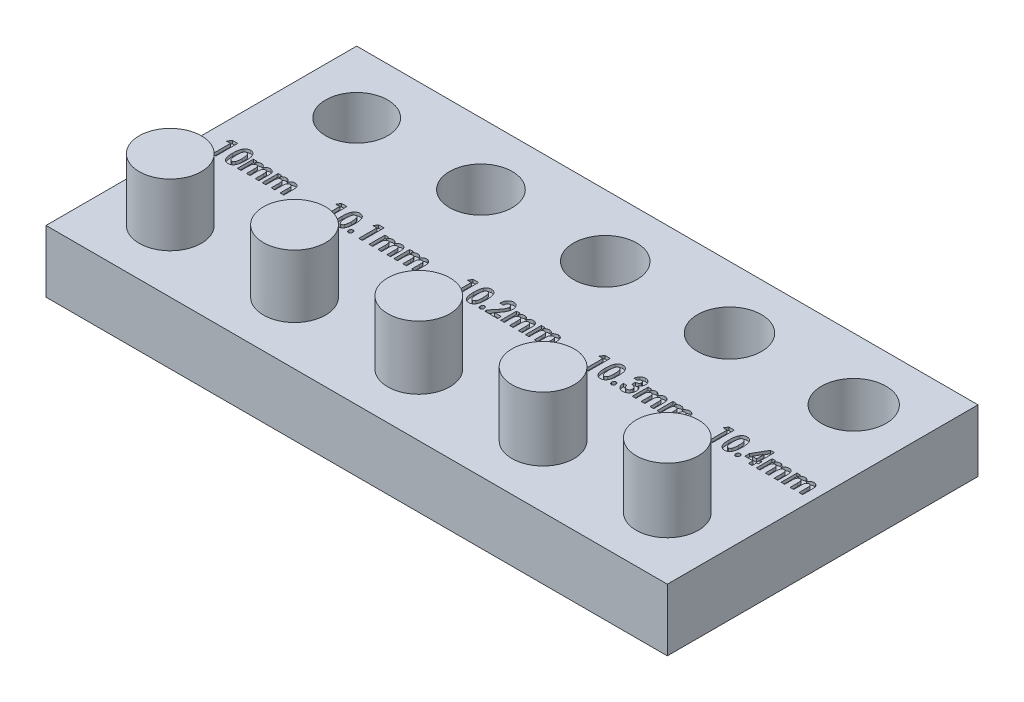
from build123d import *

# Parameters (mm, degrees)
SKETCH1_W           = 100
SKETCH1_H           = 50
BOSS_EXTRUDE1_DEPTH = 10
SKETCH2_R           = 5
BOSS_EXTRUDE2_DEPTH = 10
SKETCH4_R           = 5
BOSS_EXTRUDE3_DEPTH = 10.1
SKETCH5_R           = 5
BOSS_EXTRUDE4_DEPTH = 10.2
SKETCH6_R           = 5
BOSS_EXTRUDE5_DEPTH = 10.3
SKETCH7_R           = 5
BOSS_EXTRUDE6_DEPTH = 10.4
SKETCH8_R           = 5
SKETCH8_R_2         = 5.05
SKETCH8_R_3         = 5.1
SKETCH8_R_4         = 5.15
SKETCH8_R_5         = 5.2
CUT_EXTRUDE1_DEPTH  = 113.286063249
CUT_EXTRUDE2_DEPTH  = 0.5


with BuildPart() as part:
    # Sketch1 → Boss-Extrude1 (new body)
    with BuildSketch(Plane(origin=(0, 0, 0), x_dir=(1, 0, 0), z_dir=(0, 1, 0))):
        with Locations((50, 25)):
            Rectangle(SKETCH1_W, SKETCH1_H)
    extrude(amount=BOSS_EXTRUDE1_DEPTH)

    # Sketch2 → Boss-Extrude2 (add)
    with BuildSketch(Plane(origin=(0, 10, 0), x_dir=(1, 0, 0), z_dir=(0, 1, 0))):
        with Locations(Location((10, 10, 0), (0, 0, 270))):
            Circle(SKETCH2_R)
    extrude(amount=BOSS_EXTRUDE2_DEPTH)

    # Sketch4 → Boss-Extrude3 (add)
    with BuildSketch(Plane(origin=(0, 10, 0), x_dir=(1, 0, 0), z_dir=(0, 1, 0))):
        with Locations(Location((30, 10, 0), (0, 0, 90))):
            Circle(SKETCH4_R)
    extrude(amount=BOSS_EXTRUDE3_DEPTH)

    # Sketch5 → Boss-Extrude4 (add)
    with BuildSketch(Plane(origin=(0, 10, 0), x_dir=(1, 0, 0), z_dir=(0, 1, 0))):
        with Locations(Location((50, 10, 0), (0, 0, 90))):
            Circle(SKETCH5_R)
    extrude(amount=BOSS_EXTRUDE4_DEPTH)

    # Sketch6 → Boss-Extrude5 (add)
    with BuildSketch(Plane(origin=(0, 10, 0), x_dir=(1, 0, 0), z_dir=(0, 1, 0))):
        with Locations(Location((70, 10, 0), (0, 0, 90))):
            Circle(SKETCH6_R)
    extrude(amount=BOSS_EXTRUDE5_DEPTH)

    # Sketch7 → Boss-Extrude6 (add)
    with BuildSketch(Plane(origin=(0, 10, 0), x_dir=(1, 0, 0), z_dir=(0, 1, 0))):
        with Locations(Location((90, 10, 0), (0, 0, 90))):
            Circle(SKETCH7_R)
    extrude(amount=BOSS_EXTRUDE6_DEPTH)

    # Sketch8 → Cut-Extrude1 (cut, through all)
    with BuildSketch(Plane(origin=(0, 10, 0), x_dir=(1, 0, 0), z_dir=(0, 1, 0))):
        with Locations(Location((10, 40, 0), (0, 0, 270))):
            Circle(SKETCH8_R)
        with Locations(Location((30, 40, 0), (0, 0, 270))):
            Circle(SKETCH8_R_2)
        with Locations(Location((50, 40, 0), (0, 0, 270))):
            Circle(SKETCH8_R_3)
        with Locations(Location((70, 40, 0), (0, 0, 270))):
            Circle(SKETCH8_R_4)
        with Locations(Location((90, 40, 0), (0, 0, 270))):
            Circle(SKETCH8_R_5)
    extrude(amount=-CUT_EXTRUDE1_DEPTH, mode=Mode.SUBTRACT)

    # Sketch10 → Cut-Extrude2 (cut)
    # profile 1 of 28: a face of its own
    with BuildSketch(Plane(origin=(0, 10, 0), x_dir=(1, 0, 0), z_dir=(0, 1, 0))):
        Polygon((3.119991987, 26.863531231), (3.993589744, 26.863531231), (3.993589744, 23.363531231), (3.41025641, 23.363531231), (3.41025641, 26.280197898), (2.782051282, 26.280197898), align=None)
    # profile 2 of 28: a face of its own
    with BuildSketch(Plane(origin=(0, 10, 0), x_dir=(1, 0, 0), z_dir=(0, 1, 0))):
        with BuildLine():
            add(Edge.make_bspline(
                [(5.981270032, 26.953274821), (6.008173967, 26.952814332), (6.061207736, 26.951906603), (6.139259591, 26.942374888), (6.214687407, 26.927569704), (6.287471813, 26.907836484), (6.356803787, 26.880386126), (6.423739214, 26.848440143), (6.487530123, 26.809502048), (6.548648052, 26.765391916), (6.606797668, 26.715143493), (6.66111224, 26.658293135), (6.712639831, 26.595615959), (6.76031329, 26.526588622), (6.804503323, 26.451326063), (6.845004234, 26.369932403), (6.882202339, 26.28229196), (6.916931305, 26.188228787), (6.946826283, 26.08576442), (6.973633332, 25.97469712), (6.995722626, 25.854120838), (7.013869958, 25.724059655), (7.027780001, 25.584422419), (7.037144086, 25.435210863), (7.043808292, 25.276718564), (7.04451083, 25.167992478), (7.044871795, 25.112128988)],
                knots=[0, 0, 0, 0, 0.810083621, 1.596858849, 2.364503778, 3.124589994, 3.864555186, 4.607628296, 5.356183698, 6.112380307, 6.875979436, 7.667621523, 8.477980406, 9.317713728, 10.19185873, 11.104883277, 12.054232745, 13.058678173, 14.123410688, 15.267440163, 16.499089096, 17.81427878, 19.222286002, 20.725030497, 22.317319855, 24, 24, 24, 24], degree=3))
            add(Edge.make_bspline(
                [(7.044871795, 25.112128988), (7.044519568, 25.055563628), (7.043835259, 24.945667879), (7.037086175, 24.785783677), (7.028030643, 24.635343826), (7.012895034, 24.494885841), (6.995379106, 24.363718629), (6.971791124, 24.242461567), (6.945946956, 24.130339338), (6.914581278, 24.027759322), (6.880208808, 23.933511897), (6.842763801, 23.846089846), (6.803258368, 23.764823203), (6.760248135, 23.690189529), (6.714774038, 23.621684107), (6.665797864, 23.560157316), (6.614091596, 23.504970504), (6.560158878, 23.455350459), (6.502128035, 23.41252576), (6.441117986, 23.374958005), (6.375751937, 23.344231117), (6.307463628, 23.318054254), (6.23498792, 23.298711353), (6.159186099, 23.283624869), (6.079375025, 23.275421111), (6.024990063, 23.274337468), (5.997395833, 23.273787641)],
                knots=[0, 0, 0, 0, 1.71081453, 3.323787658, 4.839774192, 6.26836449, 7.595970589, 8.840946911, 10.003438072, 11.074586353, 12.083168054, 13.036426909, 13.950071813, 14.814594595, 15.639997211, 16.434867821, 17.190054124, 17.925665391, 18.648116427, 19.368246635, 20.089139729, 20.829625787, 21.577331027, 22.35507489, 23.165386159, 24, 24, 24, 24], degree=3))
            add(Edge.make_bspline(
                [(5.997395833, 23.273787641), (5.969800638, 23.274332986), (5.915413773, 23.275407795), (5.835387879, 23.283699155), (5.759094643, 23.298674342), (5.685773644, 23.31823311), (5.61606599, 23.344047714), (5.549665175, 23.37577837), (5.486963433, 23.41334764), (5.426947414, 23.455983515), (5.370953328, 23.50565383), (5.317272971, 23.560315466), (5.267592577, 23.621548743), (5.221455592, 23.688779283), (5.17688823, 23.760902596), (5.136302777, 23.839728499), (5.099517854, 23.924750563), (5.064583524, 24.015966784), (5.0335173, 24.115094163), (5.008070794, 24.223956324), (4.985530178, 24.342279588), (4.967862103, 24.470803961), (4.952704303, 24.608928842), (4.943684261, 24.757036376), (4.936931361, 24.914817663), (4.93624886, 25.023311904), (4.935897436, 25.079176263)],
                knots=[0, 0, 0, 0, 0.841755093, 1.658999671, 2.450397707, 3.211378007, 3.971556361, 4.714557146, 5.453063483, 6.198966026, 6.956834056, 7.73325405, 8.533847271, 9.358552316, 10.219354457, 11.118566587, 12.060352264, 13.044160935, 14.09721794, 15.226393367, 16.452674799, 17.770461372, 19.182914993, 20.690530845, 22.29593374, 24, 24, 24, 24], degree=3))
            add(Edge.make_bspline(
                [(4.935897436, 25.079176263), (4.936687199, 25.156784707), (4.938210629, 25.30648916), (4.95030892, 25.522840322), (4.969175592, 25.722760329), (4.997173849, 25.906015311), (5.03227569, 26.073018363), (5.076415315, 26.223210104), (5.127191512, 26.35788781), (5.170409025, 26.438573145), (5.191105769, 26.477213122)],
                knots=[0, 0, 0, 0, 1.297252929, 2.502363535, 3.621147991, 4.652715061, 5.59980999, 6.471330616, 7.267924592, 8, 8, 8, 8], degree=3))
            add(Edge.make_bspline(
                [(5.191105769, 26.477213122), (5.215021774, 26.514982528), (5.261500049, 26.588383448), (5.343703037, 26.685658188), (5.43215025, 26.768854185), (5.528815725, 26.835989288), (5.631778471, 26.889464185), (5.742209653, 26.926604488), (5.859555084, 26.948797008), (5.940039309, 26.95175797), (5.981270032, 26.953274821)],
                knots=[0, 0, 0, 0, 1.105920594, 2.149241908, 3.144338735, 4.104421126, 5.054332867, 6.007834239, 6.979446806, 8, 8, 8, 8], degree=3))
        make_face()
        with BuildLine():
            add(Edge.make_bspline(
                [(5.994591346, 26.325069693), (5.971523982, 26.323729444), (5.925868462, 26.321076789), (5.859856058, 26.299387455), (5.797749684, 26.265261815), (5.750988826, 26.225236159), (5.715667559, 26.186899281), (5.691461737, 26.151729307), (5.667159534, 26.112960314), (5.646778976, 26.067946165), (5.626173856, 26.019343119), (5.608029973, 25.965357702), (5.591407593, 25.90658729), (5.575765029, 25.842588375), (5.562540844, 25.772109658), (5.550667148, 25.694731829), (5.540923836, 25.609597931), (5.533488975, 25.516976257), (5.527225312, 25.416698035), (5.522232002, 25.308719493), (5.51945831, 25.193006646), (5.519308223, 25.113298967), (5.519230769, 25.072165045)],
                knots=[0, 0, 0, 0, 0.940339858, 1.861144797, 2.809637555, 3.819186654, 4.35984963, 4.934658354, 5.560031614, 6.22611613, 6.949390748, 7.716145772, 8.550073918, 9.443760858, 10.406035511, 11.477966915, 12.64070661, 13.905111414, 15.272852603, 16.744413911, 18.319923223, 20, 20, 20, 20], degree=3))
            add(Edge.make_bspline(
                [(5.519230769, 25.072165045), (5.519565371, 25.018870157), (5.520206949, 24.916680579), (5.526942936, 24.769881715), (5.535782607, 24.635977179), (5.551070743, 24.5149239), (5.568166055, 24.406246083), (5.591678554, 24.310611367), (5.617374921, 24.227364797), (5.648866343, 24.156667188), (5.68340629, 24.096419218), (5.720753139, 24.04486443), (5.760105517, 24.000995226), (5.801543022, 23.964430295), (5.8464381, 23.936683212), (5.8937806, 23.916974712), (5.943477766, 23.904492675), (5.977459033, 23.902830691), (5.994591346, 23.90199277)],
                knots=[0, 0, 0, 0, 1.848870236, 3.545091773, 5.097946739, 6.502944074, 7.777301518, 8.912039993, 9.917217284, 10.795658177, 11.591188835, 12.322652631, 13.000078385, 13.632427916, 14.233214415, 14.82200774, 15.406092437, 16, 16, 16, 16], degree=3))
            add(Edge.make_bspline(
                [(5.994591346, 23.90199277), (6.011016849, 23.90260051), (6.043564898, 23.90380478), (6.090994897, 23.915464641), (6.135851465, 23.93453501), (6.177480803, 23.961970145), (6.217200262, 23.995790746), (6.253671629, 24.037794904), (6.287377829, 24.087065361), (6.306497672, 24.123563119), (6.31640625, 24.142477545)],
                knots=[0, 0, 0, 0, 0.925893984, 1.834710589, 2.739015004, 3.664908989, 4.638009263, 5.675604566, 6.795416256, 8, 8, 8, 8], degree=3))
            add(Edge.make_bspline(
                [(6.31640625, 24.142477545), (6.328398684, 24.168436428), (6.353699561, 24.223202835), (6.38237225, 24.314637332), (6.406512633, 24.417831295), (6.426623315, 24.533262999), (6.442683966, 24.660759142), (6.453341241, 24.800452288), (6.460677459, 24.95219466), (6.461244, 25.057431692), (6.461538462, 25.112128988)],
                knots=[0, 0, 0, 0, 0.694152874, 1.464479798, 2.322501288, 3.268165404, 4.309808787, 5.443407828, 6.671202775, 8, 8, 8, 8], degree=3))
            add(Edge.make_bspline(
                [(6.461538462, 25.112128988), (6.461183854, 25.167291259), (6.460501433, 25.273447795), (6.453988391, 25.425878883), (6.444549562, 25.565048522), (6.431059945, 25.690790513), (6.412090605, 25.803077272), (6.389879322, 25.902153134), (6.364818285, 25.988492244), (6.333576307, 26.061484884), (6.299112651, 26.123379605), (6.263826454, 26.177330343), (6.224833331, 26.222419709), (6.184213214, 26.260419359), (6.140328175, 26.289461896), (6.09398936, 26.310348646), (6.044989656, 26.322509604), (6.011483228, 26.324211634), (5.994591346, 26.325069693)],
                knots=[0, 0, 0, 0, 1.867779817, 3.594432046, 5.16525305, 6.590616786, 7.874707695, 9.018912256, 10.027805832, 10.914173532, 11.700500476, 12.42480775, 13.092611851, 13.714377504, 14.302604199, 14.865867144, 15.428239906, 16, 16, 16, 16], degree=3))
        make_face(mode=Mode.SUBTRACT)
    # profile 3 of 28: a face of its own
    with BuildSketch(Plane(origin=(0, 10, 0), x_dir=(1, 0, 0), z_dir=(0, 1, 0))):
        with BuildLine():
            Line((7.448717949, 25.921223539), (8.032051282, 25.921223539))
            Line((8.032051282, 25.921223539), (8.032051282, 25.615534436))
            add(Edge.make_bspline(
                [(8.032051282, 25.615534436), (8.056285589, 25.64361868), (8.103551662, 25.698393587), (8.182035341, 25.770380072), (8.264419386, 25.831247814), (8.351207057, 25.880838565), (8.442260067, 25.918671571), (8.536920329, 25.946421759), (8.635850081, 25.962797538), (8.703198199, 25.964985078), (8.737379808, 25.966095334)],
                knots=[0, 0, 0, 0, 1.090540112, 2.126966047, 3.125293764, 4.098300752, 5.05977453, 6.019279786, 6.994712745, 8, 8, 8, 8], degree=3))
            add(Edge.make_bspline(
                [(8.737379808, 25.966095334), (8.77162349, 25.964850613), (8.839191904, 25.962394573), (8.937825851, 25.939704304), (9.031394975, 25.903180621), (9.118610109, 25.851107185), (9.200149566, 25.786547107), (9.272174154, 25.706846972), (9.337268429, 25.61487885), (9.371197037, 25.545962877), (9.388721955, 25.510366167)],
                knots=[0, 0, 0, 0, 0.973850819, 1.921567759, 2.865679866, 3.823228568, 4.803266802, 5.815841079, 6.871830922, 8, 8, 8, 8], degree=3))
            add(Edge.make_bspline(
                [(9.388721955, 25.510366167), (9.411435309, 25.546075089), (9.455701239, 25.615668007), (9.53569365, 25.707029968), (9.621126553, 25.787129936), (9.715878698, 25.851215269), (9.815617013, 25.903245965), (9.920973247, 25.939656255), (10.030676951, 25.962348759), (10.105392283, 25.964838056), (10.143129006, 25.966095334)],
                knots=[0, 0, 0, 0, 1.098093228, 2.140067753, 3.145738382, 4.132756451, 5.102304126, 6.060605189, 7.020463355, 8, 8, 8, 8], degree=3))
            add(Edge.make_bspline(
                [(10.143129006, 25.966095334), (10.181819707, 25.964727945), (10.257866517, 25.962040334), (10.367857187, 25.937498473), (10.470860549, 25.897815489), (10.564736884, 25.84233218), (10.649283142, 25.77486597), (10.722189697, 25.696997898), (10.780754514, 25.608202743), (10.820344971, 25.527133216), (10.844130942, 25.454382541), (10.860163669, 25.391604146), (10.874072967, 25.320935329), (10.885141987, 25.242287378), (10.893227451, 25.155703509), (10.89966342, 25.061264618), (10.902899411, 24.958839338), (10.903523078, 24.888005455), (10.903846154, 24.85131168)],
                knots=[0, 0, 0, 0, 1.205150579, 2.36873089, 3.494731983, 4.634655976, 5.754603255, 6.85816449, 7.945605628, 9.060419433, 9.659613848, 10.32953357, 11.079890377, 11.904406958, 12.80505806, 13.791090352, 14.855727932, 16, 16, 16, 16], degree=3))
            Line((10.903846154, 24.85131168), (10.903846154, 23.363531231))
            Line((10.903846154, 23.363531231), (10.320512821, 23.363531231))
            Line((10.320512821, 23.363531231), (10.320512821, 24.647986359))
            add(Edge.make_bspline(
                [(10.320512821, 24.647986359), (10.320235474, 24.682343087), (10.319703195, 24.748280137), (10.315927775, 24.842816061), (10.307779031, 24.928568501), (10.298696363, 25.005949394), (10.285335158, 25.074536666), (10.269652003, 25.134787448), (10.250150984, 25.185949431), (10.228059328, 25.229248708), (10.203179759, 25.265877296), (10.174749083, 25.296891972), (10.143955781, 25.323493005), (10.110535288, 25.346296069), (10.07303487, 25.361698726), (10.033398455, 25.373784895), (9.990855428, 25.382053675), (9.961345169, 25.382520865), (9.946113782, 25.382762)],
                knots=[0, 0, 0, 0, 1.772236881, 3.401257277, 4.877923168, 6.214660789, 7.418041082, 8.479558542, 9.422080423, 10.2362114, 10.981864326, 11.698701257, 12.399547248, 13.078272293, 13.774750304, 14.480246264, 15.215596233, 16, 16, 16, 16], degree=3))
            add(Edge.make_bspline(
                [(9.946113782, 25.382762), (9.922854991, 25.381794906), (9.877044871, 25.379890133), (9.810319209, 25.361239155), (9.747505626, 25.331602812), (9.689257656, 25.290495902), (9.636411277, 25.239789601), (9.590491503, 25.179381855), (9.552033244, 25.109852815), (9.525473587, 25.045313558), (9.509063156, 24.98697827), (9.49817975, 24.936601924), (9.487810291, 24.880118785), (9.481871361, 24.817217939), (9.474840523, 24.74812896), (9.471264462, 24.672784886), (9.468078258, 24.591222812), (9.467992952, 24.534876166), (9.467948718, 24.505658635)],
                knots=[0, 0, 0, 0, 0.995019793, 1.959774088, 2.945674363, 3.960072992, 5.001612944, 6.073591057, 7.199407679, 8.399317446, 9.05570996, 9.794604784, 10.608228312, 11.515401281, 12.501301556, 13.584919294, 14.747703736, 16, 16, 16, 16], degree=3))
            Line((9.467948718, 24.505658635), (9.467948718, 23.363531231))
            Line((9.467948718, 23.363531231), (8.884615385, 23.363531231))
            Line((8.884615385, 23.363531231), (8.884615385, 24.58979325))
            add(Edge.make_bspline(
                [(8.884615385, 24.58979325), (8.884484834, 24.617137972), (8.884233732, 24.669732789), (8.882216683, 24.745711924), (8.878443015, 24.815808081), (8.874763029, 24.880401708), (8.868457585, 24.9391046), (8.860434779, 24.991853103), (8.852832163, 25.03892149), (8.83841868, 25.092071482), (8.819863936, 25.15138834), (8.789368132, 25.213430214), (8.754412164, 25.266417217), (8.713334652, 25.309324854), (8.666762944, 25.341762125), (8.616496701, 25.366686077), (8.560632395, 25.379672389), (8.522192381, 25.381715534), (8.502504006, 25.382762)],
                knots=[0, 0, 0, 0, 1.330758874, 2.559580624, 3.698360641, 4.746954017, 5.707803797, 6.569949083, 7.344105641, 8.025477787, 9.248337293, 10.362310817, 11.378068743, 12.327201644, 13.232885285, 14.128226126, 15.041306709, 16, 16, 16, 16], degree=3))
            add(Edge.make_bspline(
                [(8.502504006, 25.382762), (8.480165875, 25.381822409), (8.435652414, 25.379950075), (8.371149016, 25.360473135), (8.309731114, 25.330565364), (8.252339616, 25.289054601), (8.200572706, 25.236620148), (8.154244428, 25.175221435), (8.116951085, 25.103260139), (8.090530159, 25.036970167), (8.073142628, 24.977472755), (8.061913027, 24.925705766), (8.053250636, 24.867804754), (8.045588528, 24.803972734), (8.039065453, 24.734089871), (8.035332026, 24.658065682), (8.032191429, 24.575796598), (8.032099129, 24.518983592), (8.032051282, 24.489532834)],
                knots=[0, 0, 0, 0, 0.949316131, 1.891713566, 2.844730342, 3.850640777, 4.892717095, 5.974109637, 7.114543405, 8.334943497, 9.009269386, 9.753426088, 10.589979425, 11.502713254, 12.492576578, 13.579593434, 14.745308283, 16, 16, 16, 16], degree=3))
            Line((8.032051282, 24.489532834), (8.032051282, 23.363531231))
            Line((8.032051282, 23.363531231), (7.448717949, 23.363531231))
            Line((7.448717949, 23.363531231), (7.448717949, 25.921223539))
        make_face()
    # profile 4 of 28: a face of its own
    with BuildSketch(Plane(origin=(0, 10, 0), x_dir=(1, 0, 0), z_dir=(0, 1, 0))):
        with BuildLine():
            Line((11.442307692, 25.921223539), (12.025641026, 25.921223539))
            Line((12.025641026, 25.921223539), (12.025641026, 25.615534436))
            add(Edge.make_bspline(
                [(12.025641026, 25.615534436), (12.049875333, 25.64361868), (12.097141405, 25.698393587), (12.175625084, 25.770380072), (12.25800913, 25.831247814), (12.3447968, 25.880838565), (12.435849811, 25.918671571), (12.530510072, 25.946421759), (12.629439825, 25.962797538), (12.696787942, 25.964985078), (12.730969551, 25.966095334)],
                knots=[0, 0, 0, 0, 1.090540112, 2.126966047, 3.125293764, 4.098300752, 5.05977453, 6.019279786, 6.994712745, 8, 8, 8, 8], degree=3))
            add(Edge.make_bspline(
                [(12.730969551, 25.966095334), (12.765213233, 25.964850613), (12.832781648, 25.962394573), (12.931415595, 25.939704304), (13.024984718, 25.903180621), (13.112199853, 25.851107185), (13.193739309, 25.786547107), (13.265763897, 25.706846972), (13.330858172, 25.61487885), (13.36478678, 25.545962877), (13.382311699, 25.510366167)],
                knots=[0, 0, 0, 0, 0.973850819, 1.921567759, 2.865679866, 3.823228568, 4.803266802, 5.815841079, 6.871830922, 8, 8, 8, 8], degree=3))
            add(Edge.make_bspline(
                [(13.382311699, 25.510366167), (13.405025053, 25.546075089), (13.449290982, 25.615668007), (13.529283394, 25.707029968), (13.614716296, 25.787129936), (13.709468441, 25.851215269), (13.809206757, 25.903245965), (13.914562991, 25.939656255), (14.024266695, 25.962348759), (14.098982027, 25.964838056), (14.13671875, 25.966095334)],
                knots=[0, 0, 0, 0, 1.098093228, 2.140067753, 3.145738382, 4.132756451, 5.102304126, 6.060605189, 7.020463355, 8, 8, 8, 8], degree=3))
            add(Edge.make_bspline(
                [(14.13671875, 25.966095334), (14.175409451, 25.964727945), (14.251456261, 25.962040334), (14.361446931, 25.937498473), (14.464450293, 25.897815489), (14.558326628, 25.84233218), (14.642872886, 25.77486597), (14.715779441, 25.696997898), (14.774344257, 25.608202743), (14.813934714, 25.527133216), (14.837720686, 25.454382541), (14.853753412, 25.391604146), (14.86766271, 25.320935329), (14.878731731, 25.242287378), (14.886817194, 25.155703509), (14.893253163, 25.061264618), (14.896489155, 24.958839338), (14.897112822, 24.888005455), (14.897435897, 24.85131168)],
                knots=[0, 0, 0, 0, 1.205150579, 2.36873089, 3.494731983, 4.634655976, 5.754603255, 6.85816449, 7.945605628, 9.060419433, 9.659613848, 10.32953357, 11.079890377, 11.904406958, 12.80505806, 13.791090352, 14.855727932, 16, 16, 16, 16], degree=3))
            Line((14.897435897, 24.85131168), (14.897435897, 23.363531231))
            Line((14.897435897, 23.363531231), (14.314102564, 23.363531231))
            Line((14.314102564, 23.363531231), (14.314102564, 24.647986359))
            add(Edge.make_bspline(
                [(14.314102564, 24.647986359), (14.313825218, 24.682343087), (14.313292939, 24.748280137), (14.309517518, 24.842816061), (14.301368774, 24.928568501), (14.292286107, 25.005949394), (14.278924902, 25.074536666), (14.263241746, 25.134787448), (14.243740728, 25.185949431), (14.221649072, 25.229248708), (14.196769503, 25.265877296), (14.168338827, 25.296891972), (14.137545524, 25.323493005), (14.104125031, 25.346296069), (14.066624613, 25.361698726), (14.026988199, 25.373784895), (13.984445171, 25.382053675), (13.954934913, 25.382520865), (13.939703526, 25.382762)],
                knots=[0, 0, 0, 0, 1.772236881, 3.401257277, 4.877923168, 6.214660789, 7.418041082, 8.479558542, 9.422080423, 10.2362114, 10.981864326, 11.698701257, 12.399547248, 13.078272293, 13.774750304, 14.480246264, 15.215596233, 16, 16, 16, 16], degree=3))
            add(Edge.make_bspline(
                [(13.939703526, 25.382762), (13.916444734, 25.381794906), (13.870634614, 25.379890133), (13.803908953, 25.361239155), (13.741095369, 25.331602812), (13.682847399, 25.290495902), (13.63000102, 25.239789601), (13.584081247, 25.179381855), (13.545622988, 25.109852815), (13.51906333, 25.045313558), (13.5026529, 24.98697827), (13.491769493, 24.936601924), (13.481400035, 24.880118785), (13.475461105, 24.817217939), (13.468430267, 24.74812896), (13.464854206, 24.672784886), (13.461668001, 24.591222812), (13.461582695, 24.534876166), (13.461538462, 24.505658635)],
                knots=[0, 0, 0, 0, 0.995019793, 1.959774088, 2.945674363, 3.960072992, 5.001612944, 6.073591057, 7.199407679, 8.399317446, 9.05570996, 9.794604784, 10.608228312, 11.515401281, 12.501301556, 13.584919294, 14.747703736, 16, 16, 16, 16], degree=3))
            Line((13.461538462, 24.505658635), (13.461538462, 23.363531231))
            Line((13.461538462, 23.363531231), (12.878205128, 23.363531231))
            Line((12.878205128, 23.363531231), (12.878205128, 24.58979325))
            add(Edge.make_bspline(
                [(12.878205128, 24.58979325), (12.878074577, 24.617137972), (12.877823475, 24.669732789), (12.875806426, 24.745711924), (12.872032758, 24.815808081), (12.868352772, 24.880401708), (12.862047329, 24.9391046), (12.854024522, 24.991853103), (12.846421906, 25.03892149), (12.832008424, 25.092071482), (12.813453679, 25.15138834), (12.782957876, 25.213430214), (12.748001907, 25.266417217), (12.706924395, 25.309324854), (12.660352688, 25.341762125), (12.610086445, 25.366686077), (12.554222139, 25.379672389), (12.515782124, 25.381715534), (12.49609375, 25.382762)],
                knots=[0, 0, 0, 0, 1.330758874, 2.559580624, 3.698360641, 4.746954017, 5.707803797, 6.569949083, 7.344105641, 8.025477787, 9.248337293, 10.362310817, 11.378068743, 12.327201644, 13.232885285, 14.128226126, 15.041306709, 16, 16, 16, 16], degree=3))
            add(Edge.make_bspline(
                [(12.49609375, 25.382762), (12.473755618, 25.381822409), (12.429242157, 25.379950075), (12.36473876, 25.360473135), (12.303320858, 25.330565364), (12.24592936, 25.289054601), (12.19416245, 25.236620148), (12.147834172, 25.175221435), (12.110540828, 25.103260139), (12.084119902, 25.036970167), (12.066732372, 24.977472755), (12.055502771, 24.925705766), (12.04684038, 24.867804754), (12.039178272, 24.803972734), (12.032655196, 24.734089871), (12.02892177, 24.658065682), (12.025781173, 24.575796598), (12.025688872, 24.518983592), (12.025641026, 24.489532834)],
                knots=[0, 0, 0, 0, 0.949316131, 1.891713566, 2.844730342, 3.850640777, 4.892717095, 5.974109637, 7.114543405, 8.334943497, 9.009269386, 9.753426088, 10.589979425, 11.502713254, 12.492576578, 13.579593434, 14.745308283, 16, 16, 16, 16], degree=3))
            Line((12.025641026, 24.489532834), (12.025641026, 23.363531231))
            Line((12.025641026, 23.363531231), (11.442307692, 23.363531231))
            Line((11.442307692, 23.363531231), (11.442307692, 25.921223539))
        make_face()
    # profile 5 of 28: a face of its own
    with BuildSketch(Plane(origin=(0, 10, 0), x_dir=(1, 0, 0), z_dir=(0, 1, 0))):
        Polygon((20.709735577, 26.863531231), (21.583333333, 26.863531231), (21.583333333, 23.363531231), (21, 23.363531231), (21, 26.280197898), (20.371794872, 26.280197898), align=None)
    # profile 6 of 28: a face of its own
    with BuildSketch(Plane(origin=(0, 10, 0), x_dir=(1, 0, 0), z_dir=(0, 1, 0))):
        with BuildLine():
            add(Edge.make_bspline(
                [(23.571013622, 26.953274821), (23.597917557, 26.952814332), (23.650951326, 26.951906603), (23.729003181, 26.942374888), (23.804430997, 26.927569704), (23.877215403, 26.907836484), (23.946547376, 26.880386126), (24.013482804, 26.848440143), (24.077273713, 26.809502048), (24.138391642, 26.765391916), (24.196541257, 26.715143493), (24.25085583, 26.658293135), (24.302383421, 26.595615959), (24.35005688, 26.526588622), (24.394246913, 26.451326063), (24.434747824, 26.369932403), (24.471945928, 26.28229196), (24.506674895, 26.188228787), (24.536569873, 26.08576442), (24.563376922, 25.97469712), (24.585466216, 25.854120838), (24.603613548, 25.724059655), (24.617523591, 25.584422419), (24.626887675, 25.435210863), (24.633551882, 25.276718564), (24.63425442, 25.167992478), (24.634615385, 25.112128988)],
                knots=[0, 0, 0, 0, 0.810083621, 1.596858849, 2.364503778, 3.124589994, 3.864555186, 4.607628296, 5.356183698, 6.112380307, 6.875979436, 7.667621523, 8.477980406, 9.317713728, 10.19185873, 11.104883277, 12.054232745, 13.058678173, 14.123410688, 15.267440163, 16.499089096, 17.81427878, 19.222286002, 20.725030497, 22.317319855, 24, 24, 24, 24], degree=3))
            add(Edge.make_bspline(
                [(24.634615385, 25.112128988), (24.634263158, 25.055563628), (24.633578848, 24.945667879), (24.626829764, 24.785783677), (24.617774232, 24.635343826), (24.602638623, 24.494885841), (24.585122696, 24.363718629), (24.561534713, 24.242461567), (24.535690546, 24.130339338), (24.504324868, 24.027759322), (24.469952398, 23.933511897), (24.43250739, 23.846089846), (24.393001958, 23.764823203), (24.349991725, 23.690189529), (24.304517628, 23.621684107), (24.255541454, 23.560157316), (24.203835186, 23.504970504), (24.149902468, 23.455350459), (24.091871625, 23.41252576), (24.030861575, 23.374958005), (23.965495527, 23.344231117), (23.897207218, 23.318054254), (23.82473151, 23.298711353), (23.748929688, 23.283624869), (23.669118615, 23.275421111), (23.614733653, 23.274337468), (23.587139423, 23.273787641)],
                knots=[0, 0, 0, 0, 1.71081453, 3.323787658, 4.839774192, 6.26836449, 7.595970589, 8.840946911, 10.003438072, 11.074586353, 12.083168054, 13.036426909, 13.950071813, 14.814594595, 15.639997211, 16.434867821, 17.190054124, 17.925665391, 18.648116427, 19.368246635, 20.089139729, 20.829625787, 21.577331027, 22.35507489, 23.165386159, 24, 24, 24, 24], degree=3))
            add(Edge.make_bspline(
                [(23.587139423, 23.273787641), (23.559544227, 23.274332986), (23.505157362, 23.275407795), (23.425131468, 23.283699155), (23.348838233, 23.298674342), (23.275517234, 23.31823311), (23.20580958, 23.344047714), (23.139408764, 23.37577837), (23.076707023, 23.41334764), (23.016691004, 23.455983515), (22.960696917, 23.50565383), (22.907016561, 23.560315466), (22.857336166, 23.621548743), (22.811199182, 23.688779283), (22.76663182, 23.760902596), (22.726046366, 23.839728499), (22.689261444, 23.924750563), (22.654327114, 24.015966784), (22.62326089, 24.115094163), (22.597814384, 24.223956324), (22.575273768, 24.342279588), (22.557605693, 24.470803961), (22.542447893, 24.608928842), (22.53342785, 24.757036376), (22.52667495, 24.914817663), (22.52599245, 25.023311904), (22.525641026, 25.079176263)],
                knots=[0, 0, 0, 0, 0.841755093, 1.658999671, 2.450397707, 3.211378007, 3.971556361, 4.714557146, 5.453063483, 6.198966026, 6.956834056, 7.73325405, 8.533847271, 9.358552316, 10.219354457, 11.118566587, 12.060352264, 13.044160935, 14.09721794, 15.226393367, 16.452674799, 17.770461372, 19.182914993, 20.690530845, 22.29593374, 24, 24, 24, 24], degree=3))
            add(Edge.make_bspline(
                [(22.525641026, 25.079176263), (22.526430789, 25.156784707), (22.527954219, 25.30648916), (22.54005251, 25.522840322), (22.558919182, 25.722760329), (22.586917439, 25.906015311), (22.622019279, 26.073018363), (22.666158904, 26.223210104), (22.716935102, 26.35788781), (22.760152615, 26.438573145), (22.780849359, 26.477213122)],
                knots=[0, 0, 0, 0, 1.297252929, 2.502363535, 3.621147991, 4.652715061, 5.59980999, 6.471330616, 7.267924592, 8, 8, 8, 8], degree=3))
            add(Edge.make_bspline(
                [(22.780849359, 26.477213122), (22.804765364, 26.514982528), (22.851243638, 26.588383448), (22.933446626, 26.685658188), (23.02189384, 26.768854185), (23.118559315, 26.835989288), (23.221522061, 26.889464185), (23.331953243, 26.926604488), (23.449298673, 26.948797008), (23.529782899, 26.95175797), (23.571013622, 26.953274821)],
                knots=[0, 0, 0, 0, 1.105920594, 2.149241908, 3.144338735, 4.104421126, 5.054332867, 6.007834239, 6.979446806, 8, 8, 8, 8], degree=3))
        make_face()
        with BuildLine():
            add(Edge.make_bspline(
                [(23.584334936, 26.325069693), (23.561267572, 26.323729444), (23.515612052, 26.321076789), (23.449599647, 26.299387455), (23.387493274, 26.265261815), (23.340732416, 26.225236159), (23.305411148, 26.186899281), (23.281205327, 26.151729307), (23.256903124, 26.112960314), (23.236522566, 26.067946165), (23.215917446, 26.019343119), (23.197773563, 25.965357702), (23.181151183, 25.90658729), (23.165508618, 25.842588375), (23.152284434, 25.772109658), (23.140410738, 25.694731829), (23.130667426, 25.609597931), (23.123232565, 25.516976257), (23.116968902, 25.416698035), (23.111975592, 25.308719493), (23.1092019, 25.193006646), (23.109051813, 25.113298967), (23.108974359, 25.072165045)],
                knots=[0, 0, 0, 0, 0.940339858, 1.861144797, 2.809637555, 3.819186654, 4.35984963, 4.934658354, 5.560031614, 6.22611613, 6.949390748, 7.716145772, 8.550073918, 9.443760858, 10.406035511, 11.477966915, 12.64070661, 13.905111414, 15.272852603, 16.744413911, 18.319923223, 20, 20, 20, 20], degree=3))
            add(Edge.make_bspline(
                [(23.108974359, 25.072165045), (23.109308961, 25.018870157), (23.109950539, 24.916680579), (23.116686526, 24.769881715), (23.125526197, 24.635977179), (23.140814333, 24.5149239), (23.157909644, 24.406246083), (23.181422144, 24.310611367), (23.207118511, 24.227364797), (23.238609933, 24.156667188), (23.27314988, 24.096419218), (23.310496729, 24.04486443), (23.349849107, 24.000995226), (23.391286612, 23.964430295), (23.43618169, 23.936683212), (23.48352419, 23.916974712), (23.533221356, 23.904492675), (23.567202623, 23.902830691), (23.584334936, 23.90199277)],
                knots=[0, 0, 0, 0, 1.848870236, 3.545091773, 5.097946739, 6.502944074, 7.777301518, 8.912039993, 9.917217284, 10.795658177, 11.591188835, 12.322652631, 13.000078385, 13.632427916, 14.233214415, 14.82200774, 15.406092437, 16, 16, 16, 16], degree=3))
            add(Edge.make_bspline(
                [(23.584334936, 23.90199277), (23.600760438, 23.90260051), (23.633308488, 23.90380478), (23.680738487, 23.915464641), (23.725595055, 23.93453501), (23.767224393, 23.961970145), (23.806943852, 23.995790746), (23.843415219, 24.037794904), (23.877121419, 24.087065361), (23.896241262, 24.123563119), (23.90614984, 24.142477545)],
                knots=[0, 0, 0, 0, 0.925893984, 1.834710589, 2.739015004, 3.664908989, 4.638009263, 5.675604566, 6.795416256, 8, 8, 8, 8], degree=3))
            add(Edge.make_bspline(
                [(23.90614984, 24.142477545), (23.918142273, 24.168436428), (23.94344315, 24.223202835), (23.97211584, 24.314637332), (23.996256223, 24.417831295), (24.016366905, 24.533262999), (24.032427556, 24.660759142), (24.043084831, 24.800452288), (24.050421048, 24.95219466), (24.05098759, 25.057431692), (24.051282051, 25.112128988)],
                knots=[0, 0, 0, 0, 0.694152874, 1.464479798, 2.322501288, 3.268165404, 4.309808787, 5.443407828, 6.671202775, 8, 8, 8, 8], degree=3))
            add(Edge.make_bspline(
                [(24.051282051, 25.112128988), (24.050927444, 25.167291259), (24.050245023, 25.273447795), (24.04373198, 25.425878883), (24.034293152, 25.565048522), (24.020803535, 25.690790513), (24.001834195, 25.803077272), (23.979622911, 25.902153134), (23.954561874, 25.988492244), (23.923319897, 26.061484884), (23.888856241, 26.123379605), (23.853570043, 26.177330343), (23.81457692, 26.222419709), (23.773956804, 26.260419359), (23.730071765, 26.289461896), (23.683732949, 26.310348646), (23.634733246, 26.322509604), (23.601226818, 26.324211634), (23.584334936, 26.325069693)],
                knots=[0, 0, 0, 0, 1.867779817, 3.594432046, 5.16525305, 6.590616786, 7.874707695, 9.018912256, 10.027805832, 10.914173532, 11.700500476, 12.42480775, 13.092611851, 13.714377504, 14.302604199, 14.865867144, 15.428239906, 16, 16, 16, 16], degree=3))
        make_face(mode=Mode.SUBTRACT)
    # profile 7 of 28: a face of its own
    with BuildSketch(Plane(origin=(0, 10, 0), x_dir=(1, 0, 0), z_dir=(0, 1, 0))):
        with BuildLine():
            add(Edge.make_bspline(
                [(25.330128205, 24.081479949), (25.352719143, 24.080141677), (25.396996592, 24.077518709), (25.460867841, 24.056273447), (25.518423989, 24.019966975), (25.569670313, 23.97162973), (25.613191292, 23.914114596), (25.644336816, 23.848497468), (25.663181345, 23.776830063), (25.665483083, 23.727062881), (25.666666667, 23.701471936)],
                knots=[0, 0, 0, 0, 0.960609422, 1.882760869, 2.830132045, 3.837106501, 4.868187223, 5.883146861, 6.911486045, 8, 8, 8, 8], degree=3))
            add(Edge.make_bspline(
                [(25.666666667, 23.701471936), (25.66549096, 23.675877496), (25.663204543, 23.626103515), (25.644196052, 23.554279204), (25.613235429, 23.48813746), (25.569653354, 23.430008462), (25.51867481, 23.380788524), (25.460701915, 23.344789155), (25.397150423, 23.32240115), (25.352745951, 23.319922139), (25.330128205, 23.318659436)],
                knots=[0, 0, 0, 0, 1.084858691, 2.109744679, 3.130253363, 4.165835433, 5.176218955, 6.120408829, 7.042616335, 8, 8, 8, 8], degree=3))
            add(Edge.make_bspline(
                [(25.330128205, 23.318659436), (25.307504975, 23.319912295), (25.263089738, 23.322371981), (25.199427289, 23.34496941), (25.140999821, 23.38056915), (25.089851165, 23.429818734), (25.047115337, 23.488371399), (25.016019531, 23.554250391), (24.997062793, 23.626111226), (24.99476916, 23.675880114), (24.993589744, 23.701471936)],
                knots=[0, 0, 0, 0, 0.95707319, 1.878981627, 2.831317311, 3.84137317, 4.870761765, 5.890939502, 6.915493125, 8, 8, 8, 8], degree=3))
            add(Edge.make_bspline(
                [(24.993589744, 23.701471936), (24.994777046, 23.727060223), (24.997086014, 23.776822236), (25.01587883, 23.84852661), (25.047156661, 23.913879782), (25.08983699, 23.971819959), (25.141252251, 24.020183765), (25.199260278, 24.056096065), (25.263243505, 24.077548076), (25.307531756, 24.080151598), (25.330128205, 24.081479949)],
                knots=[0, 0, 0, 0, 1.088165997, 2.116176458, 3.13081165, 4.155639559, 5.162292121, 6.117840982, 7.03969765, 8, 8, 8, 8], degree=3))
        make_face()
    # profile 8 of 28: a face of its own
    with BuildSketch(Plane(origin=(0, 10, 0), x_dir=(1, 0, 0), z_dir=(0, 1, 0))):
        Polygon((26.677684295, 26.863531231), (27.551282051, 26.863531231), (27.551282051, 23.363531231), (26.967948718, 23.363531231), (26.967948718, 26.280197898), (26.33974359, 26.280197898), align=None)
    # profile 9 of 28: a face of its own
    with BuildSketch(Plane(origin=(0, 10, 0), x_dir=(1, 0, 0), z_dir=(0, 1, 0))):
        with BuildLine():
            Line((28.628205128, 25.921223539), (29.211538462, 25.921223539))
            Line((29.211538462, 25.921223539), (29.211538462, 25.615534436))
            add(Edge.make_bspline(
                [(29.211538462, 25.615534436), (29.235772769, 25.64361868), (29.283038841, 25.698393587), (29.36152252, 25.770380072), (29.443906565, 25.831247814), (29.530694236, 25.880838565), (29.621747246, 25.918671571), (29.716407508, 25.946421759), (29.815337261, 25.962797538), (29.882685378, 25.964985078), (29.916866987, 25.966095334)],
                knots=[0, 0, 0, 0, 1.090540112, 2.126966047, 3.125293764, 4.098300752, 5.05977453, 6.019279786, 6.994712745, 8, 8, 8, 8], degree=3))
            add(Edge.make_bspline(
                [(29.916866987, 25.966095334), (29.951110669, 25.964850613), (30.018679083, 25.962394573), (30.117313031, 25.939704304), (30.210882154, 25.903180621), (30.298097288, 25.851107185), (30.379636745, 25.786547107), (30.451661333, 25.706846972), (30.516755608, 25.61487885), (30.550684216, 25.545962877), (30.568209135, 25.510366167)],
                knots=[0, 0, 0, 0, 0.973850819, 1.921567759, 2.865679866, 3.823228568, 4.803266802, 5.815841079, 6.871830922, 8, 8, 8, 8], degree=3))
            add(Edge.make_bspline(
                [(30.568209135, 25.510366167), (30.590922489, 25.546075089), (30.635188418, 25.615668007), (30.715180829, 25.707029968), (30.800613732, 25.787129936), (30.895365877, 25.851215269), (30.995104193, 25.903245965), (31.100460427, 25.939656255), (31.210164131, 25.962348759), (31.284879463, 25.964838056), (31.322616186, 25.966095334)],
                knots=[0, 0, 0, 0, 1.098093228, 2.140067753, 3.145738382, 4.132756451, 5.102304126, 6.060605189, 7.020463355, 8, 8, 8, 8], degree=3))
            add(Edge.make_bspline(
                [(31.322616186, 25.966095334), (31.361306886, 25.964727945), (31.437353697, 25.962040334), (31.547344367, 25.937498473), (31.650347729, 25.897815489), (31.744224064, 25.84233218), (31.828770322, 25.77486597), (31.901676876, 25.696997898), (31.960241693, 25.608202743), (31.99983215, 25.527133216), (32.023618121, 25.454382541), (32.039650848, 25.391604146), (32.053560146, 25.320935329), (32.064629167, 25.242287378), (32.07271463, 25.155703509), (32.079150599, 25.061264618), (32.082386591, 24.958839338), (32.083010258, 24.888005455), (32.083333333, 24.85131168)],
                knots=[0, 0, 0, 0, 1.205150579, 2.36873089, 3.494731983, 4.634655976, 5.754603255, 6.85816449, 7.945605628, 9.060419433, 9.659613848, 10.32953357, 11.079890377, 11.904406958, 12.80505806, 13.791090352, 14.855727932, 16, 16, 16, 16], degree=3))
            Line((32.083333333, 24.85131168), (32.083333333, 23.363531231))
            Line((32.083333333, 23.363531231), (31.5, 23.363531231))
            Line((31.5, 23.363531231), (31.5, 24.647986359))
            add(Edge.make_bspline(
                [(31.5, 24.647986359), (31.499722654, 24.682343087), (31.499190374, 24.748280137), (31.495414954, 24.842816061), (31.48726621, 24.928568501), (31.478183542, 25.005949394), (31.464822337, 25.074536666), (31.449139182, 25.134787448), (31.429638164, 25.185949431), (31.407546508, 25.229248708), (31.382666939, 25.265877296), (31.354236262, 25.296891972), (31.32344296, 25.323493005), (31.290022467, 25.346296069), (31.252522049, 25.361698726), (31.212885634, 25.373784895), (31.170342607, 25.382053675), (31.140832349, 25.382520865), (31.125600962, 25.382762)],
                knots=[0, 0, 0, 0, 1.772236881, 3.401257277, 4.877923168, 6.214660789, 7.418041082, 8.479558542, 9.422080423, 10.2362114, 10.981864326, 11.698701257, 12.399547248, 13.078272293, 13.774750304, 14.480246264, 15.215596233, 16, 16, 16, 16], degree=3))
            add(Edge.make_bspline(
                [(31.125600962, 25.382762), (31.10234217, 25.381794906), (31.05653205, 25.379890133), (30.989806389, 25.361239155), (30.926992805, 25.331602812), (30.868744835, 25.290495902), (30.815898456, 25.239789601), (30.769978683, 25.179381855), (30.731520424, 25.109852815), (30.704960766, 25.045313558), (30.688550336, 24.98697827), (30.677666929, 24.936601924), (30.667297471, 24.880118785), (30.661358541, 24.817217939), (30.654327703, 24.74812896), (30.650751642, 24.672784886), (30.647565437, 24.591222812), (30.647480131, 24.534876166), (30.647435897, 24.505658635)],
                knots=[0, 0, 0, 0, 0.995019793, 1.959774088, 2.945674363, 3.960072992, 5.001612944, 6.073591057, 7.199407679, 8.399317446, 9.05570996, 9.794604784, 10.608228312, 11.515401281, 12.501301556, 13.584919294, 14.747703736, 16, 16, 16, 16], degree=3))
            Line((30.647435897, 24.505658635), (30.647435897, 23.363531231))
            Line((30.647435897, 23.363531231), (30.064102564, 23.363531231))
            Line((30.064102564, 23.363531231), (30.064102564, 24.58979325))
            add(Edge.make_bspline(
                [(30.064102564, 24.58979325), (30.063972013, 24.617137972), (30.063720911, 24.669732789), (30.061703862, 24.745711924), (30.057930194, 24.815808081), (30.054250208, 24.880401708), (30.047944764, 24.9391046), (30.039921958, 24.991853103), (30.032319342, 25.03892149), (30.01790586, 25.092071482), (29.999351115, 25.15138834), (29.968855312, 25.213430214), (29.933899343, 25.266417217), (29.892821831, 25.309324854), (29.846250124, 25.341762125), (29.795983881, 25.366686077), (29.740119575, 25.379672389), (29.70167956, 25.381715534), (29.681991186, 25.382762)],
                knots=[0, 0, 0, 0, 1.330758874, 2.559580624, 3.698360641, 4.746954017, 5.707803797, 6.569949083, 7.344105641, 8.025477787, 9.248337293, 10.362310817, 11.378068743, 12.327201644, 13.232885285, 14.128226126, 15.041306709, 16, 16, 16, 16], degree=3))
            add(Edge.make_bspline(
                [(29.681991186, 25.382762), (29.659653054, 25.381822409), (29.615139593, 25.379950075), (29.550636196, 25.360473135), (29.489218294, 25.330565364), (29.431826796, 25.289054601), (29.380059886, 25.236620148), (29.333731608, 25.175221435), (29.296438264, 25.103260139), (29.270017338, 25.036970167), (29.252629807, 24.977472755), (29.241400206, 24.925705766), (29.232737816, 24.867804754), (29.225075708, 24.803972734), (29.218552632, 24.734089871), (29.214819206, 24.658065682), (29.211678609, 24.575796598), (29.211586308, 24.518983592), (29.211538462, 24.489532834)],
                knots=[0, 0, 0, 0, 0.949316131, 1.891713566, 2.844730342, 3.850640777, 4.892717095, 5.974109637, 7.114543405, 8.334943497, 9.009269386, 9.753426088, 10.589979425, 11.502713254, 12.492576578, 13.579593434, 14.745308283, 16, 16, 16, 16], degree=3))
            Line((29.211538462, 24.489532834), (29.211538462, 23.363531231))
            Line((29.211538462, 23.363531231), (28.628205128, 23.363531231))
            Line((28.628205128, 23.363531231), (28.628205128, 25.921223539))
        make_face()
    # profile 10 of 28: a face of its own
    with BuildSketch(Plane(origin=(0, 10, 0), x_dir=(1, 0, 0), z_dir=(0, 1, 0))):
        with BuildLine():
            Line((32.621794872, 25.921223539), (33.205128205, 25.921223539))
            Line((33.205128205, 25.921223539), (33.205128205, 25.615534436))
            add(Edge.make_bspline(
                [(33.205128205, 25.615534436), (33.229362512, 25.64361868), (33.276628585, 25.698393587), (33.355112264, 25.770380072), (33.437496309, 25.831247814), (33.52428398, 25.880838565), (33.61533699, 25.918671571), (33.709997252, 25.946421759), (33.808927004, 25.962797538), (33.876275122, 25.964985078), (33.910456731, 25.966095334)],
                knots=[0, 0, 0, 0, 1.090540112, 2.126966047, 3.125293764, 4.098300752, 5.05977453, 6.019279786, 6.994712745, 8, 8, 8, 8], degree=3))
            add(Edge.make_bspline(
                [(33.910456731, 25.966095334), (33.944700413, 25.964850613), (34.012268827, 25.962394573), (34.110902774, 25.939704304), (34.204471898, 25.903180621), (34.291687032, 25.851107185), (34.373226489, 25.786547107), (34.445251077, 25.706846972), (34.510345352, 25.61487885), (34.54427396, 25.545962877), (34.561798878, 25.510366167)],
                knots=[0, 0, 0, 0, 0.973850819, 1.921567759, 2.865679866, 3.823228568, 4.803266802, 5.815841079, 6.871830922, 8, 8, 8, 8], degree=3))
            add(Edge.make_bspline(
                [(34.561798878, 25.510366167), (34.584512232, 25.546075089), (34.628778162, 25.615668007), (34.708770573, 25.707029968), (34.794203476, 25.787129936), (34.888955621, 25.851215269), (34.988693936, 25.903245965), (35.094050171, 25.939656255), (35.203753875, 25.962348759), (35.278469206, 25.964838056), (35.316205929, 25.966095334)],
                knots=[0, 0, 0, 0, 1.098093228, 2.140067753, 3.145738382, 4.132756451, 5.102304126, 6.060605189, 7.020463355, 8, 8, 8, 8], degree=3))
            add(Edge.make_bspline(
                [(35.316205929, 25.966095334), (35.35489663, 25.964727945), (35.430943441, 25.962040334), (35.54093411, 25.937498473), (35.643937473, 25.897815489), (35.737813808, 25.84233218), (35.822360065, 25.77486597), (35.89526662, 25.696997898), (35.953831437, 25.608202743), (35.993421894, 25.527133216), (36.017207865, 25.454382541), (36.033240592, 25.391604146), (36.04714989, 25.320935329), (36.05821891, 25.242287378), (36.066304374, 25.155703509), (36.072740343, 25.061264618), (36.075976334, 24.958839338), (36.076600001, 24.888005455), (36.076923077, 24.85131168)],
                knots=[0, 0, 0, 0, 1.205150579, 2.36873089, 3.494731983, 4.634655976, 5.754603255, 6.85816449, 7.945605628, 9.060419433, 9.659613848, 10.32953357, 11.079890377, 11.904406958, 12.80505806, 13.791090352, 14.855727932, 16, 16, 16, 16], degree=3))
            Line((36.076923077, 24.85131168), (36.076923077, 23.363531231))
            Line((36.076923077, 23.363531231), (35.493589744, 23.363531231))
            Line((35.493589744, 23.363531231), (35.493589744, 24.647986359))
            add(Edge.make_bspline(
                [(35.493589744, 24.647986359), (35.493312398, 24.682343087), (35.492780118, 24.748280137), (35.489004698, 24.842816061), (35.480855954, 24.928568501), (35.471773286, 25.005949394), (35.458412081, 25.074536666), (35.442728926, 25.134787448), (35.423227908, 25.185949431), (35.401136251, 25.229248708), (35.376256682, 25.265877296), (35.347826006, 25.296891972), (35.317032704, 25.323493005), (35.283612211, 25.346296069), (35.246111793, 25.361698726), (35.206475378, 25.373784895), (35.163932351, 25.382053675), (35.134422092, 25.382520865), (35.119190705, 25.382762)],
                knots=[0, 0, 0, 0, 1.772236881, 3.401257277, 4.877923168, 6.214660789, 7.418041082, 8.479558542, 9.422080423, 10.2362114, 10.981864326, 11.698701257, 12.399547248, 13.078272293, 13.774750304, 14.480246264, 15.215596233, 16, 16, 16, 16], degree=3))
            add(Edge.make_bspline(
                [(35.119190705, 25.382762), (35.095931914, 25.381794906), (35.050121794, 25.379890133), (34.983396132, 25.361239155), (34.920582549, 25.331602812), (34.862334579, 25.290495902), (34.8094882, 25.239789601), (34.763568426, 25.179381855), (34.725110168, 25.109852815), (34.69855051, 25.045313558), (34.682140079, 24.98697827), (34.671256673, 24.936601924), (34.660887214, 24.880118785), (34.654948284, 24.817217939), (34.647917446, 24.74812896), (34.644341385, 24.672784886), (34.641155181, 24.591222812), (34.641069875, 24.534876166), (34.641025641, 24.505658635)],
                knots=[0, 0, 0, 0, 0.995019793, 1.959774088, 2.945674363, 3.960072992, 5.001612944, 6.073591057, 7.199407679, 8.399317446, 9.05570996, 9.794604784, 10.608228312, 11.515401281, 12.501301556, 13.584919294, 14.747703736, 16, 16, 16, 16], degree=3))
            Line((34.641025641, 24.505658635), (34.641025641, 23.363531231))
            Line((34.641025641, 23.363531231), (34.057692308, 23.363531231))
            Line((34.057692308, 23.363531231), (34.057692308, 24.58979325))
            add(Edge.make_bspline(
                [(34.057692308, 24.58979325), (34.057561757, 24.617137972), (34.057310655, 24.669732789), (34.055293606, 24.745711924), (34.051519938, 24.815808081), (34.047839952, 24.880401708), (34.041534508, 24.9391046), (34.033511702, 24.991853103), (34.025909086, 25.03892149), (34.011495603, 25.092071482), (33.992940859, 25.15138834), (33.962445055, 25.213430214), (33.927489087, 25.266417217), (33.886411575, 25.309324854), (33.839839867, 25.341762125), (33.789573624, 25.366686077), (33.733709318, 25.379672389), (33.695269304, 25.381715534), (33.675580929, 25.382762)],
                knots=[0, 0, 0, 0, 1.330758874, 2.559580624, 3.698360641, 4.746954017, 5.707803797, 6.569949083, 7.344105641, 8.025477787, 9.248337293, 10.362310817, 11.378068743, 12.327201644, 13.232885285, 14.128226126, 15.041306709, 16, 16, 16, 16], degree=3))
            add(Edge.make_bspline(
                [(33.675580929, 25.382762), (33.653242798, 25.381822409), (33.608729337, 25.379950075), (33.544225939, 25.360473135), (33.482808038, 25.330565364), (33.425416539, 25.289054601), (33.373649629, 25.236620148), (33.327321351, 25.175221435), (33.290028008, 25.103260139), (33.263607082, 25.036970167), (33.246219551, 24.977472755), (33.23498995, 24.925705766), (33.22632756, 24.867804754), (33.218665451, 24.803972734), (33.212142376, 24.734089871), (33.20840895, 24.658065682), (33.205268352, 24.575796598), (33.205176052, 24.518983592), (33.205128205, 24.489532834)],
                knots=[0, 0, 0, 0, 0.949316131, 1.891713566, 2.844730342, 3.850640777, 4.892717095, 5.974109637, 7.114543405, 8.334943497, 9.009269386, 9.753426088, 10.589979425, 11.502713254, 12.492576578, 13.579593434, 14.745308283, 16, 16, 16, 16], degree=3))
            Line((33.205128205, 24.489532834), (33.205128205, 23.363531231))
            Line((33.205128205, 23.363531231), (32.621794872, 23.363531231))
            Line((32.621794872, 23.363531231), (32.621794872, 25.921223539))
        make_face()
    # profile 11 of 28: a face of its own
    with BuildSketch(Plane(origin=(0, 10, 0), x_dir=(1, 0, 0), z_dir=(0, 1, 0))):
        Polygon((41.889222756, 26.863531231), (42.762820513, 26.863531231), (42.762820513, 23.363531231), (42.179487179, 23.363531231), (42.179487179, 26.280197898), (41.551282051, 26.280197898), align=None)
    # profile 12 of 28: a face of its own
    with BuildSketch(Plane(origin=(0, 10, 0), x_dir=(1, 0, 0), z_dir=(0, 1, 0))):
        with BuildLine():
            add(Edge.make_bspline(
                [(44.750500801, 26.953274821), (44.777404737, 26.952814332), (44.830438505, 26.951906603), (44.90849036, 26.942374888), (44.983918177, 26.927569704), (45.056702583, 26.907836484), (45.126034556, 26.880386126), (45.192969983, 26.848440143), (45.256760892, 26.809502048), (45.317878821, 26.765391916), (45.376028437, 26.715143493), (45.430343009, 26.658293135), (45.4818706, 26.595615959), (45.529544059, 26.526588622), (45.573734093, 26.451326063), (45.614235003, 26.369932403), (45.651433108, 26.28229196), (45.686162074, 26.188228787), (45.716057052, 26.08576442), (45.742864101, 25.97469712), (45.764953396, 25.854120838), (45.783100727, 25.724059655), (45.79701077, 25.584422419), (45.806374855, 25.435210863), (45.813039061, 25.276718564), (45.8137416, 25.167992478), (45.814102564, 25.112128988)],
                knots=[0, 0, 0, 0, 0.810083621, 1.596858849, 2.364503778, 3.124589994, 3.864555186, 4.607628296, 5.356183698, 6.112380307, 6.875979436, 7.667621523, 8.477980406, 9.317713728, 10.19185873, 11.104883277, 12.054232745, 13.058678173, 14.123410688, 15.267440163, 16.499089096, 17.81427878, 19.222286002, 20.725030497, 22.317319855, 24, 24, 24, 24], degree=3))
            add(Edge.make_bspline(
                [(45.814102564, 25.112128988), (45.813750337, 25.055563628), (45.813066028, 24.945667879), (45.806316944, 24.785783677), (45.797261412, 24.635343826), (45.782125803, 24.494885841), (45.764609875, 24.363718629), (45.741021893, 24.242461567), (45.715177725, 24.130339338), (45.683812047, 24.027759322), (45.649439577, 23.933511897), (45.61199457, 23.846089846), (45.572489138, 23.764823203), (45.529478904, 23.690189529), (45.484004808, 23.621684107), (45.435028633, 23.560157316), (45.383322366, 23.504970504), (45.329389648, 23.455350459), (45.271358804, 23.41252576), (45.210348755, 23.374958005), (45.144982706, 23.344231117), (45.076694397, 23.318054254), (45.00421869, 23.298711353), (44.928416868, 23.283624869), (44.848605794, 23.275421111), (44.794220832, 23.274337468), (44.766626603, 23.273787641)],
                knots=[0, 0, 0, 0, 1.71081453, 3.323787658, 4.839774192, 6.26836449, 7.595970589, 8.840946911, 10.003438072, 11.074586353, 12.083168054, 13.036426909, 13.950071813, 14.814594595, 15.639997211, 16.434867821, 17.190054124, 17.925665391, 18.648116427, 19.368246635, 20.089139729, 20.829625787, 21.577331027, 22.35507489, 23.165386159, 24, 24, 24, 24], degree=3))
            add(Edge.make_bspline(
                [(44.766626603, 23.273787641), (44.739031407, 23.274332986), (44.684644542, 23.275407795), (44.604618648, 23.283699155), (44.528325412, 23.298674342), (44.455004413, 23.31823311), (44.385296759, 23.344047714), (44.318895944, 23.37577837), (44.256194202, 23.41334764), (44.196178183, 23.455983515), (44.140184097, 23.50565383), (44.08650374, 23.560315466), (44.036823346, 23.621548743), (43.990686362, 23.688779283), (43.946119, 23.760902596), (43.905533546, 23.839728499), (43.868748623, 23.924750563), (43.833814293, 24.015966784), (43.802748069, 24.115094163), (43.777301563, 24.223956324), (43.754760947, 24.342279588), (43.737092872, 24.470803961), (43.721935072, 24.608928842), (43.71291503, 24.757036376), (43.70616213, 24.914817663), (43.705479629, 25.023311904), (43.705128205, 25.079176263)],
                knots=[0, 0, 0, 0, 0.841755093, 1.658999671, 2.450397707, 3.211378007, 3.971556361, 4.714557146, 5.453063483, 6.198966026, 6.956834056, 7.73325405, 8.533847271, 9.358552316, 10.219354457, 11.118566587, 12.060352264, 13.044160935, 14.09721794, 15.226393367, 16.452674799, 17.770461372, 19.182914993, 20.690530845, 22.29593374, 24, 24, 24, 24], degree=3))
            add(Edge.make_bspline(
                [(43.705128205, 25.079176263), (43.705917968, 25.156784707), (43.707441398, 25.30648916), (43.71953969, 25.522840322), (43.738406361, 25.722760329), (43.766404618, 25.906015311), (43.801506459, 26.073018363), (43.845646084, 26.223210104), (43.896422281, 26.35788781), (43.939639795, 26.438573145), (43.960336538, 26.477213122)],
                knots=[0, 0, 0, 0, 1.297252929, 2.502363535, 3.621147991, 4.652715061, 5.59980999, 6.471330616, 7.267924592, 8, 8, 8, 8], degree=3))
            add(Edge.make_bspline(
                [(43.960336538, 26.477213122), (43.984252544, 26.514982528), (44.030730818, 26.588383448), (44.112933806, 26.685658188), (44.20138102, 26.768854185), (44.298046494, 26.835989288), (44.40100924, 26.889464185), (44.511440422, 26.926604488), (44.628785853, 26.948797008), (44.709270079, 26.95175797), (44.750500801, 26.953274821)],
                knots=[0, 0, 0, 0, 1.105920594, 2.149241908, 3.144338735, 4.104421126, 5.054332867, 6.007834239, 6.979446806, 8, 8, 8, 8], degree=3))
        make_face()
        with BuildLine():
            add(Edge.make_bspline(
                [(44.763822115, 26.325069693), (44.740754751, 26.323729444), (44.695099232, 26.321076789), (44.629086827, 26.299387455), (44.566980453, 26.265261815), (44.520219596, 26.225236159), (44.484898328, 26.186899281), (44.460692506, 26.151729307), (44.436390303, 26.112960314), (44.416009746, 26.067946165), (44.395404625, 26.019343119), (44.377260742, 25.965357702), (44.360638362, 25.90658729), (44.344995798, 25.842588375), (44.331771614, 25.772109658), (44.319897918, 25.694731829), (44.310154605, 25.609597931), (44.302719744, 25.516976257), (44.296456081, 25.416698035), (44.291462771, 25.308719493), (44.28868908, 25.193006646), (44.288538992, 25.113298967), (44.288461538, 25.072165045)],
                knots=[0, 0, 0, 0, 0.940339858, 1.861144797, 2.809637555, 3.819186654, 4.35984963, 4.934658354, 5.560031614, 6.22611613, 6.949390748, 7.716145772, 8.550073918, 9.443760858, 10.406035511, 11.477966915, 12.64070661, 13.905111414, 15.272852603, 16.744413911, 18.319923223, 20, 20, 20, 20], degree=3))
            add(Edge.make_bspline(
                [(44.288461538, 25.072165045), (44.28879614, 25.018870157), (44.289437719, 24.916680579), (44.296173705, 24.769881715), (44.305013377, 24.635977179), (44.320301512, 24.5149239), (44.337396824, 24.406246083), (44.360909323, 24.310611367), (44.38660569, 24.227364797), (44.418097112, 24.156667188), (44.452637059, 24.096419218), (44.489983908, 24.04486443), (44.529336286, 24.000995226), (44.570773791, 23.964430295), (44.61566887, 23.936683212), (44.663011369, 23.916974712), (44.712708535, 23.904492675), (44.746689803, 23.902830691), (44.763822115, 23.90199277)],
                knots=[0, 0, 0, 0, 1.848870236, 3.545091773, 5.097946739, 6.502944074, 7.777301518, 8.912039993, 9.917217284, 10.795658177, 11.591188835, 12.322652631, 13.000078385, 13.632427916, 14.233214415, 14.82200774, 15.406092437, 16, 16, 16, 16], degree=3))
            add(Edge.make_bspline(
                [(44.763822115, 23.90199277), (44.780247618, 23.90260051), (44.812795667, 23.90380478), (44.860225666, 23.915464641), (44.905082234, 23.93453501), (44.946711572, 23.961970145), (44.986431031, 23.995790746), (45.022902399, 24.037794904), (45.056608598, 24.087065361), (45.075728442, 24.123563119), (45.085637019, 24.142477545)],
                knots=[0, 0, 0, 0, 0.925893984, 1.834710589, 2.739015004, 3.664908989, 4.638009263, 5.675604566, 6.795416256, 8, 8, 8, 8], degree=3))
            add(Edge.make_bspline(
                [(45.085637019, 24.142477545), (45.097629453, 24.168436428), (45.12293033, 24.223202835), (45.151603019, 24.314637332), (45.175743403, 24.417831295), (45.195854084, 24.533262999), (45.211914735, 24.660759142), (45.22257201, 24.800452288), (45.229908228, 24.95219466), (45.230474769, 25.057431692), (45.230769231, 25.112128988)],
                knots=[0, 0, 0, 0, 0.694152874, 1.464479798, 2.322501288, 3.268165404, 4.309808787, 5.443407828, 6.671202775, 8, 8, 8, 8], degree=3))
            add(Edge.make_bspline(
                [(45.230769231, 25.112128988), (45.230414623, 25.167291259), (45.229732202, 25.273447795), (45.22321916, 25.425878883), (45.213780331, 25.565048522), (45.200290715, 25.690790513), (45.181321374, 25.803077272), (45.159110091, 25.902153134), (45.134049054, 25.988492244), (45.102807077, 26.061484884), (45.06834342, 26.123379605), (45.033057223, 26.177330343), (44.9940641, 26.222419709), (44.953443984, 26.260419359), (44.909558944, 26.289461896), (44.863220129, 26.310348646), (44.814220425, 26.322509604), (44.780713997, 26.324211634), (44.763822115, 26.325069693)],
                knots=[0, 0, 0, 0, 1.867779817, 3.594432046, 5.16525305, 6.590616786, 7.874707695, 9.018912256, 10.027805832, 10.914173532, 11.700500476, 12.42480775, 13.092611851, 13.714377504, 14.302604199, 14.865867144, 15.428239906, 16, 16, 16, 16], degree=3))
        make_face(mode=Mode.SUBTRACT)
    # profile 13 of 28: a face of its own
    with BuildSketch(Plane(origin=(0, 10, 0), x_dir=(1, 0, 0), z_dir=(0, 1, 0))):
        with BuildLine():
            add(Edge.make_bspline(
                [(46.509615385, 24.081479949), (46.532206323, 24.080141677), (46.576483772, 24.077518709), (46.64035502, 24.056273447), (46.697911168, 24.019966975), (46.749157493, 23.97162973), (46.792678472, 23.914114596), (46.823823996, 23.848497468), (46.842668525, 23.776830063), (46.844970262, 23.727062881), (46.846153846, 23.701471936)],
                knots=[0, 0, 0, 0, 0.960609422, 1.882760869, 2.830132045, 3.837106501, 4.868187223, 5.883146861, 6.911486045, 8, 8, 8, 8], degree=3))
            add(Edge.make_bspline(
                [(46.846153846, 23.701471936), (46.84497814, 23.675877496), (46.842691722, 23.626103515), (46.823683232, 23.554279204), (46.792722609, 23.48813746), (46.749140534, 23.430008462), (46.69816199, 23.380788524), (46.640189094, 23.344789155), (46.576637602, 23.32240115), (46.532233131, 23.319922139), (46.509615385, 23.318659436)],
                knots=[0, 0, 0, 0, 1.084858691, 2.109744679, 3.130253363, 4.165835433, 5.176218955, 6.120408829, 7.042616335, 8, 8, 8, 8], degree=3))
            add(Edge.make_bspline(
                [(46.509615385, 23.318659436), (46.486992155, 23.319912295), (46.442576917, 23.322371981), (46.378914469, 23.34496941), (46.320487001, 23.38056915), (46.269338345, 23.429818734), (46.226602517, 23.488371399), (46.195506711, 23.554250391), (46.176549972, 23.626111226), (46.17425634, 23.675880114), (46.173076923, 23.701471936)],
                knots=[0, 0, 0, 0, 0.95707319, 1.878981627, 2.831317311, 3.84137317, 4.870761765, 5.890939502, 6.915493125, 8, 8, 8, 8], degree=3))
            add(Edge.make_bspline(
                [(46.173076923, 23.701471936), (46.174264225, 23.727060223), (46.176573193, 23.776822236), (46.195366009, 23.84852661), (46.226643841, 23.913879782), (46.26932417, 23.971819959), (46.320739431, 24.020183765), (46.378747458, 24.056096065), (46.442730684, 24.077548076), (46.487018935, 24.080151598), (46.509615385, 24.081479949)],
                knots=[0, 0, 0, 0, 1.088165997, 2.116176458, 3.13081165, 4.155639559, 5.162292121, 6.117840982, 7.03969765, 8, 8, 8, 8], degree=3))
        make_face()
    # profile 14 of 28: a face of its own
    with BuildSketch(Plane(origin=(0, 10, 0), x_dir=(1, 0, 0), z_dir=(0, 1, 0))):
        with BuildLine():
            Line((47.923076923, 25.696864565), (47.33974359, 25.696864565))
            add(Edge.make_bspline(
                [(47.33974359, 25.696864565), (47.342108317, 25.744363824), (47.346723903, 25.837075115), (47.364759669, 25.971930277), (47.389493322, 26.099308012), (47.423122892, 26.218646047), (47.464727191, 26.330227823), (47.513522793, 26.434166357), (47.570585172, 26.53038258), (47.63571791, 26.617789715), (47.707248224, 26.696318896), (47.783546409, 26.765581256), (47.865674166, 26.823837029), (47.952960008, 26.870328023), (48.044152621, 26.908750983), (48.141011992, 26.933843766), (48.242409925, 26.951016594), (48.311890852, 26.952513114), (48.347255609, 26.953274821)],
                knots=[0, 0, 0, 0, 1.269305313, 2.477489865, 3.629044493, 4.731310679, 5.783719112, 6.805319749, 7.79306713, 8.765259087, 9.710524508, 10.625162063, 11.51158693, 12.391066257, 13.261310488, 14.146812431, 15.056755129, 16, 16, 16, 16], degree=3))
            add(Edge.make_bspline(
                [(48.347255609, 26.953274821), (48.39061728, 26.951727247), (48.475538766, 26.948696407), (48.599025692, 26.922817287), (48.714433553, 26.8798542), (48.821318592, 26.819387421), (48.919079841, 26.74331529), (49.006991735, 26.65175133), (49.083490809, 26.544587075), (49.148770814, 26.425196405), (49.202714066, 26.298531073), (49.240318788, 26.167790189), (49.264790452, 26.036188367), (49.26775476, 25.947737558), (49.269230769, 25.903695494)],
                knots=[0, 0, 0, 0, 1.003210393, 1.964733271, 2.906532242, 3.844217989, 4.796760408, 5.765035796, 6.772803977, 7.836096724, 8.910471658, 9.953354137, 10.980919347, 12, 12, 12, 12], degree=3))
            add(Edge.make_bspline(
                [(49.269230769, 25.903695494), (49.267398566, 25.850065827), (49.263639858, 25.740046196), (49.234399011, 25.572746317), (49.189449615, 25.399292547), (49.136519496, 25.251982374), (49.083827791, 25.129788363), (49.036264933, 25.032596859), (48.980403395, 24.931682487), (48.917791284, 24.826201435), (48.847910264, 24.716357629), (48.769711745, 24.60271975), (48.68418301, 24.485040183), (48.623670159, 24.405969747), (48.592648237, 24.365434276)],
                knots=[0, 0, 0, 0, 1.127479747, 2.31299041, 3.562475824, 4.893372559, 5.600139701, 6.360784708, 7.168152508, 8.025508804, 8.940506395, 9.905826311, 10.926421544, 12, 12, 12, 12], degree=3))
            Line((48.592648237, 24.365434276), (48.270833333, 23.946864565))
            Line((48.270833333, 23.946864565), (49.314102564, 23.946864565))
            Line((49.314102564, 23.946864565), (49.314102564, 23.363531231))
            Line((49.314102564, 23.363531231), (47.25, 23.363531231))
            Line((47.25, 23.363531231), (47.25, 23.681840526))
            Line((47.25, 23.681840526), (48.146033654, 24.784705109))
            add(Edge.make_bspline(
                [(48.146033654, 24.784705109), (48.172061073, 24.816887407), (48.22248836, 24.879239571), (48.294118624, 24.970671566), (48.358205062, 25.058039132), (48.415273732, 25.140619799), (48.467042849, 25.217344758), (48.510607236, 25.290115265), (48.547807855, 25.357594695), (48.587507208, 25.439749069), (48.62608459, 25.536927674), (48.660510093, 25.64932505), (48.681053778, 25.756414052), (48.684323894, 25.826027593), (48.685897436, 25.859524821)],
                knots=[0, 0, 0, 0, 1.215753565, 2.355483366, 3.411334622, 4.397754696, 5.304027903, 6.129309018, 6.888101407, 7.566633178, 8.808237149, 9.954953849, 11.015947539, 12, 12, 12, 12], degree=3))
            add(Edge.make_bspline(
                [(48.685897436, 25.859524821), (48.684873314, 25.891895759), (48.682900574, 25.954251115), (48.662508455, 26.043227761), (48.630546034, 26.123883478), (48.584819736, 26.193750962), (48.52981937, 26.252101261), (48.465402286, 26.294631448), (48.392830462, 26.320495432), (48.341858546, 26.323518548), (48.315705128, 26.325069693)],
                knots=[0, 0, 0, 0, 1.168587381, 2.251021637, 3.281965197, 4.289793634, 5.251952378, 6.161307466, 7.05657667, 8, 8, 8, 8], degree=3))
            add(Edge.make_bspline(
                [(48.315705128, 26.325069693), (48.302115358, 26.324492259), (48.275414669, 26.323357737), (48.236153927, 26.315484956), (48.19896292, 26.302015818), (48.163267639, 26.283523147), (48.129427649, 26.259321928), (48.097294216, 26.229803459), (48.067064836, 26.19517831), (48.028837517, 26.141369773), (47.987763462, 26.062533038), (47.952621241, 25.953793129), (47.929344079, 25.830316781), (47.925233338, 25.742783068), (47.923076923, 25.696864565)],
                knots=[0, 0, 0, 0, 0.598367134, 1.175650097, 1.755130846, 2.33515974, 2.94056673, 3.581665943, 4.252637092, 4.960933808, 6.484809243, 8.144700195, 9.977583824, 12, 12, 12, 12], degree=3))
        make_face()
    # profile 15 of 28: a face of its own
    with BuildSketch(Plane(origin=(0, 10, 0), x_dir=(1, 0, 0), z_dir=(0, 1, 0))):
        with BuildLine():
            Line((49.807692308, 25.921223539), (50.391025641, 25.921223539))
            Line((50.391025641, 25.921223539), (50.391025641, 25.615534436))
            add(Edge.make_bspline(
                [(50.391025641, 25.615534436), (50.415259948, 25.64361868), (50.462526021, 25.698393587), (50.5410097, 25.770380072), (50.623393745, 25.831247814), (50.710181416, 25.880838565), (50.801234426, 25.918671571), (50.895894688, 25.946421759), (50.99482444, 25.962797538), (51.062172558, 25.964985078), (51.096354167, 25.966095334)],
                knots=[0, 0, 0, 0, 1.090540112, 2.126966047, 3.125293764, 4.098300752, 5.05977453, 6.019279786, 6.994712745, 8, 8, 8, 8], degree=3))
            add(Edge.make_bspline(
                [(51.096354167, 25.966095334), (51.130597849, 25.964850613), (51.198166263, 25.962394573), (51.29680021, 25.939704304), (51.390369334, 25.903180621), (51.477584468, 25.851107185), (51.559123925, 25.786547107), (51.631148513, 25.706846972), (51.696242788, 25.61487885), (51.730171396, 25.545962877), (51.747696314, 25.510366167)],
                knots=[0, 0, 0, 0, 0.973850819, 1.921567759, 2.865679866, 3.823228568, 4.803266802, 5.815841079, 6.871830922, 8, 8, 8, 8], degree=3))
            add(Edge.make_bspline(
                [(51.747696314, 25.510366167), (51.770409668, 25.546075089), (51.814675598, 25.615668007), (51.894668009, 25.707029968), (51.980100912, 25.787129936), (52.074853057, 25.851215269), (52.174591372, 25.903245965), (52.279947606, 25.939656255), (52.38965131, 25.962348759), (52.464366642, 25.964838056), (52.502103365, 25.966095334)],
                knots=[0, 0, 0, 0, 1.098093228, 2.140067753, 3.145738382, 4.132756451, 5.102304126, 6.060605189, 7.020463355, 8, 8, 8, 8], degree=3))
            add(Edge.make_bspline(
                [(52.502103365, 25.966095334), (52.540794066, 25.964727945), (52.616840876, 25.962040334), (52.726831546, 25.937498473), (52.829834908, 25.897815489), (52.923711243, 25.84233218), (53.008257501, 25.77486597), (53.081164056, 25.696997898), (53.139728873, 25.608202743), (53.17931933, 25.527133216), (53.203105301, 25.454382541), (53.219138028, 25.391604146), (53.233047325, 25.320935329), (53.244116346, 25.242287378), (53.25220181, 25.155703509), (53.258637779, 25.061264618), (53.26187377, 24.958839338), (53.262497437, 24.888005455), (53.262820513, 24.85131168)],
                knots=[0, 0, 0, 0, 1.205150579, 2.36873089, 3.494731983, 4.634655976, 5.754603255, 6.85816449, 7.945605628, 9.060419433, 9.659613848, 10.32953357, 11.079890377, 11.904406958, 12.80505806, 13.791090352, 14.855727932, 16, 16, 16, 16], degree=3))
            Line((53.262820513, 24.85131168), (53.262820513, 23.363531231))
            Line((53.262820513, 23.363531231), (52.679487179, 23.363531231))
            Line((52.679487179, 23.363531231), (52.679487179, 24.647986359))
            add(Edge.make_bspline(
                [(52.679487179, 24.647986359), (52.679209833, 24.682343087), (52.678677554, 24.748280137), (52.674902134, 24.842816061), (52.66675339, 24.928568501), (52.657670722, 25.005949394), (52.644309517, 25.074536666), (52.628626362, 25.134787448), (52.609125343, 25.185949431), (52.587033687, 25.229248708), (52.562154118, 25.265877296), (52.533723442, 25.296891972), (52.50293014, 25.323493005), (52.469509647, 25.346296069), (52.432009229, 25.361698726), (52.392372814, 25.373784895), (52.349829786, 25.382053675), (52.320319528, 25.382520865), (52.305088141, 25.382762)],
                knots=[0, 0, 0, 0, 1.772236881, 3.401257277, 4.877923168, 6.214660789, 7.418041082, 8.479558542, 9.422080423, 10.2362114, 10.981864326, 11.698701257, 12.399547248, 13.078272293, 13.774750304, 14.480246264, 15.215596233, 16, 16, 16, 16], degree=3))
            add(Edge.make_bspline(
                [(52.305088141, 25.382762), (52.28182935, 25.381794906), (52.23601923, 25.379890133), (52.169293568, 25.361239155), (52.106479985, 25.331602812), (52.048232015, 25.290495902), (51.995385636, 25.239789601), (51.949465862, 25.179381855), (51.911007603, 25.109852815), (51.884447946, 25.045313558), (51.868037515, 24.98697827), (51.857154108, 24.936601924), (51.84678465, 24.880118785), (51.84084572, 24.817217939), (51.833814882, 24.74812896), (51.830238821, 24.672784886), (51.827052617, 24.591222812), (51.826967311, 24.534876166), (51.826923077, 24.505658635)],
                knots=[0, 0, 0, 0, 0.995019793, 1.959774088, 2.945674363, 3.960072992, 5.001612944, 6.073591057, 7.199407679, 8.399317446, 9.05570996, 9.794604784, 10.608228312, 11.515401281, 12.501301556, 13.584919294, 14.747703736, 16, 16, 16, 16], degree=3))
            Line((51.826923077, 24.505658635), (51.826923077, 23.363531231))
            Line((51.826923077, 23.363531231), (51.243589744, 23.363531231))
            Line((51.243589744, 23.363531231), (51.243589744, 24.58979325))
            add(Edge.make_bspline(
                [(51.243589744, 24.58979325), (51.243459192, 24.617137972), (51.243208091, 24.669732789), (51.241191042, 24.745711924), (51.237417374, 24.815808081), (51.233737388, 24.880401708), (51.227431944, 24.9391046), (51.219409138, 24.991853103), (51.211806522, 25.03892149), (51.197393039, 25.092071482), (51.178838295, 25.15138834), (51.148342491, 25.213430214), (51.113386523, 25.266417217), (51.072309011, 25.309324854), (51.025737303, 25.341762125), (50.97547106, 25.366686077), (50.919606754, 25.379672389), (50.881166739, 25.381715534), (50.861478365, 25.382762)],
                knots=[0, 0, 0, 0, 1.330758874, 2.559580624, 3.698360641, 4.746954017, 5.707803797, 6.569949083, 7.344105641, 8.025477787, 9.248337293, 10.362310817, 11.378068743, 12.327201644, 13.232885285, 14.128226126, 15.041306709, 16, 16, 16, 16], degree=3))
            add(Edge.make_bspline(
                [(50.861478365, 25.382762), (50.839140234, 25.381822409), (50.794626773, 25.379950075), (50.730123375, 25.360473135), (50.668705473, 25.330565364), (50.611313975, 25.289054601), (50.559547065, 25.236620148), (50.513218787, 25.175221435), (50.475925444, 25.103260139), (50.449504518, 25.036970167), (50.432116987, 24.977472755), (50.420887386, 24.925705766), (50.412224995, 24.867804754), (50.404562887, 24.803972734), (50.398039811, 24.734089871), (50.394306385, 24.658065682), (50.391165788, 24.575796598), (50.391073488, 24.518983592), (50.391025641, 24.489532834)],
                knots=[0, 0, 0, 0, 0.949316131, 1.891713566, 2.844730342, 3.850640777, 4.892717095, 5.974109637, 7.114543405, 8.334943497, 9.009269386, 9.753426088, 10.589979425, 11.502713254, 12.492576578, 13.579593434, 14.745308283, 16, 16, 16, 16], degree=3))
            Line((50.391025641, 24.489532834), (50.391025641, 23.363531231))
            Line((50.391025641, 23.363531231), (49.807692308, 23.363531231))
            Line((49.807692308, 23.363531231), (49.807692308, 25.921223539))
        make_face()
    # profile 16 of 28: a face of its own
    with BuildSketch(Plane(origin=(0, 10, 0), x_dir=(1, 0, 0), z_dir=(0, 1, 0))):
        with BuildLine():
            Line((53.801282051, 25.921223539), (54.384615385, 25.921223539))
            Line((54.384615385, 25.921223539), (54.384615385, 25.615534436))
            add(Edge.make_bspline(
                [(54.384615385, 25.615534436), (54.408849692, 25.64361868), (54.456115764, 25.698393587), (54.534599443, 25.770380072), (54.616983489, 25.831247814), (54.703771159, 25.880838565), (54.79482417, 25.918671571), (54.889484431, 25.946421759), (54.988414184, 25.962797538), (55.055762301, 25.964985078), (55.08994391, 25.966095334)],
                knots=[0, 0, 0, 0, 1.090540112, 2.126966047, 3.125293764, 4.098300752, 5.05977453, 6.019279786, 6.994712745, 8, 8, 8, 8], degree=3))
            add(Edge.make_bspline(
                [(55.08994391, 25.966095334), (55.124187592, 25.964850613), (55.191756007, 25.962394573), (55.290389954, 25.939704304), (55.383959077, 25.903180621), (55.471174212, 25.851107185), (55.552713668, 25.786547107), (55.624738256, 25.706846972), (55.689832531, 25.61487885), (55.723761139, 25.545962877), (55.741286058, 25.510366167)],
                knots=[0, 0, 0, 0, 0.973850819, 1.921567759, 2.865679866, 3.823228568, 4.803266802, 5.815841079, 6.871830922, 8, 8, 8, 8], degree=3))
            add(Edge.make_bspline(
                [(55.741286058, 25.510366167), (55.763999412, 25.546075089), (55.808265341, 25.615668007), (55.888257753, 25.707029968), (55.973690655, 25.787129936), (56.0684428, 25.851215269), (56.168181116, 25.903245965), (56.27353735, 25.939656255), (56.383241054, 25.962348759), (56.457956386, 25.964838056), (56.495693109, 25.966095334)],
                knots=[0, 0, 0, 0, 1.098093228, 2.140067753, 3.145738382, 4.132756451, 5.102304126, 6.060605189, 7.020463355, 8, 8, 8, 8], degree=3))
            add(Edge.make_bspline(
                [(56.495693109, 25.966095334), (56.53438381, 25.964727945), (56.61043062, 25.962040334), (56.72042129, 25.937498473), (56.823424652, 25.897815489), (56.917300987, 25.84233218), (57.001847245, 25.77486597), (57.074753799, 25.696997898), (57.133318616, 25.608202743), (57.172909073, 25.527133216), (57.196695045, 25.454382541), (57.212727771, 25.391604146), (57.226637069, 25.320935329), (57.23770609, 25.242287378), (57.245791553, 25.155703509), (57.252227522, 25.061264618), (57.255463514, 24.958839338), (57.256087181, 24.888005455), (57.256410256, 24.85131168)],
                knots=[0, 0, 0, 0, 1.205150579, 2.36873089, 3.494731983, 4.634655976, 5.754603255, 6.85816449, 7.945605628, 9.060419433, 9.659613848, 10.32953357, 11.079890377, 11.904406958, 12.80505806, 13.791090352, 14.855727932, 16, 16, 16, 16], degree=3))
            Line((57.256410256, 24.85131168), (57.256410256, 23.363531231))
            Line((57.256410256, 23.363531231), (56.673076923, 23.363531231))
            Line((56.673076923, 23.363531231), (56.673076923, 24.647986359))
            add(Edge.make_bspline(
                [(56.673076923, 24.647986359), (56.672799577, 24.682343087), (56.672267298, 24.748280137), (56.668491877, 24.842816061), (56.660343133, 24.928568501), (56.651260466, 25.005949394), (56.637899261, 25.074536666), (56.622216105, 25.134787448), (56.602715087, 25.185949431), (56.580623431, 25.229248708), (56.555743862, 25.265877296), (56.527313186, 25.296891972), (56.496519883, 25.323493005), (56.46309939, 25.346296069), (56.425598972, 25.361698726), (56.385962558, 25.373784895), (56.34341953, 25.382053675), (56.313909272, 25.382520865), (56.298677885, 25.382762)],
                knots=[0, 0, 0, 0, 1.772236881, 3.401257277, 4.877923168, 6.214660789, 7.418041082, 8.479558542, 9.422080423, 10.2362114, 10.981864326, 11.698701257, 12.399547248, 13.078272293, 13.774750304, 14.480246264, 15.215596233, 16, 16, 16, 16], degree=3))
            add(Edge.make_bspline(
                [(56.298677885, 25.382762), (56.275419093, 25.381794906), (56.229608973, 25.379890133), (56.162883312, 25.361239155), (56.100069728, 25.331602812), (56.041821758, 25.290495902), (55.988975379, 25.239789601), (55.943055606, 25.179381855), (55.904597347, 25.109852815), (55.878037689, 25.045313558), (55.861627259, 24.98697827), (55.850743852, 24.936601924), (55.840374394, 24.880118785), (55.834435464, 24.817217939), (55.827404626, 24.74812896), (55.823828565, 24.672784886), (55.82064236, 24.591222812), (55.820557054, 24.534876166), (55.820512821, 24.505658635)],
                knots=[0, 0, 0, 0, 0.995019793, 1.959774088, 2.945674363, 3.960072992, 5.001612944, 6.073591057, 7.199407679, 8.399317446, 9.05570996, 9.794604784, 10.608228312, 11.515401281, 12.501301556, 13.584919294, 14.747703736, 16, 16, 16, 16], degree=3))
            Line((55.820512821, 24.505658635), (55.820512821, 23.363531231))
            Line((55.820512821, 23.363531231), (55.237179487, 23.363531231))
            Line((55.237179487, 23.363531231), (55.237179487, 24.58979325))
            add(Edge.make_bspline(
                [(55.237179487, 24.58979325), (55.237048936, 24.617137972), (55.236797834, 24.669732789), (55.234780785, 24.745711924), (55.231007117, 24.815808081), (55.227327131, 24.880401708), (55.221021688, 24.9391046), (55.212998881, 24.991853103), (55.205396265, 25.03892149), (55.190982783, 25.092071482), (55.172428038, 25.15138834), (55.141932235, 25.213430214), (55.106976266, 25.266417217), (55.065898754, 25.309324854), (55.019327047, 25.341762125), (54.969060804, 25.366686077), (54.913196498, 25.379672389), (54.874756483, 25.381715534), (54.855068109, 25.382762)],
                knots=[0, 0, 0, 0, 1.330758874, 2.559580624, 3.698360641, 4.746954017, 5.707803797, 6.569949083, 7.344105641, 8.025477787, 9.248337293, 10.362310817, 11.378068743, 12.327201644, 13.232885285, 14.128226126, 15.041306709, 16, 16, 16, 16], degree=3))
            add(Edge.make_bspline(
                [(54.855068109, 25.382762), (54.832729977, 25.381822409), (54.788216516, 25.379950075), (54.723713119, 25.360473135), (54.662295217, 25.330565364), (54.604903719, 25.289054601), (54.553136809, 25.236620148), (54.506808531, 25.175221435), (54.469515187, 25.103260139), (54.443094261, 25.036970167), (54.425706731, 24.977472755), (54.414477129, 24.925705766), (54.405814739, 24.867804754), (54.398152631, 24.803972734), (54.391629555, 24.734089871), (54.387896129, 24.658065682), (54.384755532, 24.575796598), (54.384663231, 24.518983592), (54.384615385, 24.489532834)],
                knots=[0, 0, 0, 0, 0.949316131, 1.891713566, 2.844730342, 3.850640777, 4.892717095, 5.974109637, 7.114543405, 8.334943497, 9.009269386, 9.753426088, 10.589979425, 11.502713254, 12.492576578, 13.579593434, 14.745308283, 16, 16, 16, 16], degree=3))
            Line((54.384615385, 24.489532834), (54.384615385, 23.363531231))
            Line((54.384615385, 23.363531231), (53.801282051, 23.363531231))
            Line((53.801282051, 23.363531231), (53.801282051, 25.921223539))
        make_face()
    # profile 17 of 28: a face of its own
    with BuildSketch(Plane(origin=(0, 10, 0), x_dir=(1, 0, 0), z_dir=(0, 1, 0))):
        Polygon((63.068709936, 26.863531231), (63.942307692, 26.863531231), (63.942307692, 23.363531231), (63.358974359, 23.363531231), (63.358974359, 26.280197898), (62.730769231, 26.280197898), align=None)
    # profile 18 of 28: a face of its own
    with BuildSketch(Plane(origin=(0, 10, 0), x_dir=(1, 0, 0), z_dir=(0, 1, 0))):
        with BuildLine():
            add(Edge.make_bspline(
                [(65.929987981, 26.953274821), (65.956891916, 26.952814332), (66.009925685, 26.951906603), (66.08797754, 26.942374888), (66.163405356, 26.927569704), (66.236189762, 26.907836484), (66.305521735, 26.880386126), (66.372457163, 26.848440143), (66.436248072, 26.809502048), (66.497366001, 26.765391916), (66.555515616, 26.715143493), (66.609830189, 26.658293135), (66.66135778, 26.595615959), (66.709031239, 26.526588622), (66.753221272, 26.451326063), (66.793722183, 26.369932403), (66.830920287, 26.28229196), (66.865649254, 26.188228787), (66.895544232, 26.08576442), (66.922351281, 25.97469712), (66.944440575, 25.854120838), (66.962587907, 25.724059655), (66.97649795, 25.584422419), (66.985862034, 25.435210863), (66.992526241, 25.276718564), (66.993228779, 25.167992478), (66.993589744, 25.112128988)],
                knots=[0, 0, 0, 0, 0.810083621, 1.596858849, 2.364503778, 3.124589994, 3.864555186, 4.607628296, 5.356183698, 6.112380307, 6.875979436, 7.667621523, 8.477980406, 9.317713728, 10.19185873, 11.104883277, 12.054232745, 13.058678173, 14.123410688, 15.267440163, 16.499089096, 17.81427878, 19.222286002, 20.725030497, 22.317319855, 24, 24, 24, 24], degree=3))
            add(Edge.make_bspline(
                [(66.993589744, 25.112128988), (66.993237517, 25.055563628), (66.992553207, 24.945667879), (66.985804123, 24.785783677), (66.976748591, 24.635343826), (66.961612982, 24.494885841), (66.944097055, 24.363718629), (66.920509072, 24.242461567), (66.894664905, 24.130339338), (66.863299227, 24.027759322), (66.828926757, 23.933511897), (66.791481749, 23.846089846), (66.751976317, 23.764823203), (66.708966084, 23.690189529), (66.663491987, 23.621684107), (66.614515813, 23.560157316), (66.562809545, 23.504970504), (66.508876827, 23.455350459), (66.450845984, 23.41252576), (66.389835934, 23.374958005), (66.324469886, 23.344231117), (66.256181577, 23.318054254), (66.183705869, 23.298711353), (66.107904047, 23.283624869), (66.028092974, 23.275421111), (65.973708012, 23.274337468), (65.946113782, 23.273787641)],
                knots=[0, 0, 0, 0, 1.71081453, 3.323787658, 4.839774192, 6.26836449, 7.595970589, 8.840946911, 10.003438072, 11.074586353, 12.083168054, 13.036426909, 13.950071813, 14.814594595, 15.639997211, 16.434867821, 17.190054124, 17.925665391, 18.648116427, 19.368246635, 20.089139729, 20.829625787, 21.577331027, 22.35507489, 23.165386159, 24, 24, 24, 24], degree=3))
            add(Edge.make_bspline(
                [(65.946113782, 23.273787641), (65.918518586, 23.274332986), (65.864131721, 23.275407795), (65.784105827, 23.283699155), (65.707812592, 23.298674342), (65.634491593, 23.31823311), (65.564783939, 23.344047714), (65.498383123, 23.37577837), (65.435681382, 23.41334764), (65.375665363, 23.455983515), (65.319671276, 23.50565383), (65.26599092, 23.560315466), (65.216310525, 23.621548743), (65.170173541, 23.688779283), (65.125606179, 23.760902596), (65.085020725, 23.839728499), (65.048235803, 23.924750563), (65.013301473, 24.015966784), (64.982235249, 24.115094163), (64.956788743, 24.223956324), (64.934248127, 24.342279588), (64.916580052, 24.470803961), (64.901422252, 24.608928842), (64.892402209, 24.757036376), (64.885649309, 24.914817663), (64.884966809, 25.023311904), (64.884615385, 25.079176263)],
                knots=[0, 0, 0, 0, 0.841755093, 1.658999671, 2.450397707, 3.211378007, 3.971556361, 4.714557146, 5.453063483, 6.198966026, 6.956834056, 7.73325405, 8.533847271, 9.358552316, 10.219354457, 11.118566587, 12.060352264, 13.044160935, 14.09721794, 15.226393367, 16.452674799, 17.770461372, 19.182914993, 20.690530845, 22.29593374, 24, 24, 24, 24], degree=3))
            add(Edge.make_bspline(
                [(64.884615385, 25.079176263), (64.885405148, 25.156784707), (64.886928578, 25.30648916), (64.899026869, 25.522840322), (64.917893541, 25.722760329), (64.945891798, 25.906015311), (64.980993638, 26.073018363), (65.025133263, 26.223210104), (65.075909461, 26.35788781), (65.119126974, 26.438573145), (65.139823718, 26.477213122)],
                knots=[0, 0, 0, 0, 1.297252929, 2.502363535, 3.621147991, 4.652715061, 5.59980999, 6.471330616, 7.267924592, 8, 8, 8, 8], degree=3))
            add(Edge.make_bspline(
                [(65.139823718, 26.477213122), (65.163739723, 26.514982528), (65.210217997, 26.588383448), (65.292420985, 26.685658188), (65.380868199, 26.768854185), (65.477533674, 26.835989288), (65.58049642, 26.889464185), (65.690927602, 26.926604488), (65.808273032, 26.948797008), (65.888757258, 26.95175797), (65.929987981, 26.953274821)],
                knots=[0, 0, 0, 0, 1.105920594, 2.149241908, 3.144338735, 4.104421126, 5.054332867, 6.007834239, 6.979446806, 8, 8, 8, 8], degree=3))
        make_face()
        with BuildLine():
            add(Edge.make_bspline(
                [(65.943309295, 26.325069693), (65.920241931, 26.323729444), (65.874586411, 26.321076789), (65.808574006, 26.299387455), (65.746467633, 26.265261815), (65.699706775, 26.225236159), (65.664385507, 26.186899281), (65.640179686, 26.151729307), (65.615877483, 26.112960314), (65.595496925, 26.067946165), (65.574891805, 26.019343119), (65.556747922, 25.965357702), (65.540125542, 25.90658729), (65.524482977, 25.842588375), (65.511258793, 25.772109658), (65.499385097, 25.694731829), (65.489641785, 25.609597931), (65.482206924, 25.516976257), (65.475943261, 25.416698035), (65.470949951, 25.308719493), (65.468176259, 25.193006646), (65.468026172, 25.113298967), (65.467948718, 25.072165045)],
                knots=[0, 0, 0, 0, 0.940339858, 1.861144797, 2.809637555, 3.819186654, 4.35984963, 4.934658354, 5.560031614, 6.22611613, 6.949390748, 7.716145772, 8.550073918, 9.443760858, 10.406035511, 11.477966915, 12.64070661, 13.905111414, 15.272852603, 16.744413911, 18.319923223, 20, 20, 20, 20], degree=3))
            add(Edge.make_bspline(
                [(65.467948718, 25.072165045), (65.46828332, 25.018870157), (65.468924898, 24.916680579), (65.475660885, 24.769881715), (65.484500556, 24.635977179), (65.499788692, 24.5149239), (65.516884003, 24.406246083), (65.540396503, 24.310611367), (65.56609287, 24.227364797), (65.597584292, 24.156667188), (65.632124239, 24.096419218), (65.669471088, 24.04486443), (65.708823466, 24.000995226), (65.750260971, 23.964430295), (65.795156049, 23.936683212), (65.842498549, 23.916974712), (65.892195715, 23.904492675), (65.926176982, 23.902830691), (65.943309295, 23.90199277)],
                knots=[0, 0, 0, 0, 1.848870236, 3.545091773, 5.097946739, 6.502944074, 7.777301518, 8.912039993, 9.917217284, 10.795658177, 11.591188835, 12.322652631, 13.000078385, 13.632427916, 14.233214415, 14.82200774, 15.406092437, 16, 16, 16, 16], degree=3))
            add(Edge.make_bspline(
                [(65.943309295, 23.90199277), (65.959734797, 23.90260051), (65.992282847, 23.90380478), (66.039712846, 23.915464641), (66.084569414, 23.93453501), (66.126198752, 23.961970145), (66.165918211, 23.995790746), (66.202389578, 24.037794904), (66.236095778, 24.087065361), (66.255215621, 24.123563119), (66.265124199, 24.142477545)],
                knots=[0, 0, 0, 0, 0.925893984, 1.834710589, 2.739015004, 3.664908989, 4.638009263, 5.675604566, 6.795416256, 8, 8, 8, 8], degree=3))
            add(Edge.make_bspline(
                [(66.265124199, 24.142477545), (66.277116632, 24.168436428), (66.302417509, 24.223202835), (66.331090199, 24.314637332), (66.355230582, 24.417831295), (66.375341264, 24.533262999), (66.391401915, 24.660759142), (66.40205919, 24.800452288), (66.409395407, 24.95219466), (66.409961949, 25.057431692), (66.41025641, 25.112128988)],
                knots=[0, 0, 0, 0, 0.694152874, 1.464479798, 2.322501288, 3.268165404, 4.309808787, 5.443407828, 6.671202775, 8, 8, 8, 8], degree=3))
            add(Edge.make_bspline(
                [(66.41025641, 25.112128988), (66.409901803, 25.167291259), (66.409219382, 25.273447795), (66.402706339, 25.425878883), (66.393267511, 25.565048522), (66.379777894, 25.690790513), (66.360808554, 25.803077272), (66.33859727, 25.902153134), (66.313536233, 25.988492244), (66.282294256, 26.061484884), (66.2478306, 26.123379605), (66.212544402, 26.177330343), (66.173551279, 26.222419709), (66.132931163, 26.260419359), (66.089046124, 26.289461896), (66.042707308, 26.310348646), (65.993707604, 26.322509604), (65.960201177, 26.324211634), (65.943309295, 26.325069693)],
                knots=[0, 0, 0, 0, 1.867779817, 3.594432046, 5.16525305, 6.590616786, 7.874707695, 9.018912256, 10.027805832, 10.914173532, 11.700500476, 12.42480775, 13.092611851, 13.714377504, 14.302604199, 14.865867144, 15.428239906, 16, 16, 16, 16], degree=3))
        make_face(mode=Mode.SUBTRACT)
    # profile 19 of 28: a face of its own
    with BuildSketch(Plane(origin=(0, 10, 0), x_dir=(1, 0, 0), z_dir=(0, 1, 0))):
        with BuildLine():
            add(Edge.make_bspline(
                [(67.689102564, 24.081479949), (67.711693502, 24.080141677), (67.755970951, 24.077518709), (67.8198422, 24.056273447), (67.877398348, 24.019966975), (67.928644672, 23.97162973), (67.972165651, 23.914114596), (68.003311175, 23.848497468), (68.022155704, 23.776830063), (68.024457442, 23.727062881), (68.025641026, 23.701471936)],
                knots=[0, 0, 0, 0, 0.960609422, 1.882760869, 2.830132045, 3.837106501, 4.868187223, 5.883146861, 6.911486045, 8, 8, 8, 8], degree=3))
            add(Edge.make_bspline(
                [(68.025641026, 23.701471936), (68.024465319, 23.675877496), (68.022178902, 23.626103515), (68.003170411, 23.554279204), (67.972209788, 23.48813746), (67.928627713, 23.430008462), (67.877649169, 23.380788524), (67.819676274, 23.344789155), (67.756124782, 23.32240115), (67.71172031, 23.319922139), (67.689102564, 23.318659436)],
                knots=[0, 0, 0, 0, 1.084858691, 2.109744679, 3.130253363, 4.165835433, 5.176218955, 6.120408829, 7.042616335, 8, 8, 8, 8], degree=3))
            add(Edge.make_bspline(
                [(67.689102564, 23.318659436), (67.666479334, 23.319912295), (67.622064097, 23.322371981), (67.558401648, 23.34496941), (67.49997418, 23.38056915), (67.448825524, 23.429818734), (67.406089696, 23.488371399), (67.37499389, 23.554250391), (67.356037152, 23.626111226), (67.353743519, 23.675880114), (67.352564103, 23.701471936)],
                knots=[0, 0, 0, 0, 0.95707319, 1.878981627, 2.831317311, 3.84137317, 4.870761765, 5.890939502, 6.915493125, 8, 8, 8, 8], degree=3))
            add(Edge.make_bspline(
                [(67.352564103, 23.701471936), (67.353751405, 23.727060223), (67.356060373, 23.776822236), (67.374853189, 23.84852661), (67.40613102, 23.913879782), (67.448811349, 23.971819959), (67.50022661, 24.020183765), (67.558234637, 24.056096065), (67.622217864, 24.077548076), (67.666506115, 24.080151598), (67.689102564, 24.081479949)],
                knots=[0, 0, 0, 0, 1.088165997, 2.116176458, 3.13081165, 4.155639559, 5.162292121, 6.117840982, 7.03969765, 8, 8, 8, 8], degree=3))
        make_face()
    # profile 20 of 28: a face of its own
    with BuildSketch(Plane(origin=(0, 10, 0), x_dir=(1, 0, 0), z_dir=(0, 1, 0))):
        with BuildLine():
            Line((69.192307692, 26.010967129), (68.608974359, 26.010967129))
            add(Edge.make_bspline(
                [(68.608974359, 26.010967129), (68.613033987, 26.042341675), (68.620982082, 26.103767954), (68.639111667, 26.193130583), (68.663232199, 26.277265359), (68.691178871, 26.357041578), (68.724023504, 26.432161734), (68.762028857, 26.502482879), (68.80460101, 26.56823507), (68.837389337, 26.608143349), (68.853665865, 26.627954308)],
                knots=[0, 0, 0, 0, 1.126731312, 2.205957436, 3.244303589, 4.242248259, 5.215189797, 6.161333731, 7.087263486, 8, 8, 8, 8], degree=3))
            add(Edge.make_bspline(
                [(68.853665865, 26.627954308), (68.877198172, 26.653969485), (68.923316162, 26.704953337), (69.000742783, 26.771157928), (69.082198997, 26.827922181), (69.16909199, 26.873414238), (69.259910105, 26.909705473), (69.355537026, 26.934688134), (69.455383375, 26.950765618), (69.523641397, 26.952429921), (69.558293269, 26.953274821)],
                knots=[0, 0, 0, 0, 1.048513237, 2.054848343, 3.040049861, 4.012717704, 4.98256709, 5.959422354, 6.964080213, 8, 8, 8, 8], degree=3))
            add(Edge.make_bspline(
                [(69.558293269, 26.953274821), (69.589179727, 26.952465736), (69.650048733, 26.950871245), (69.739475005, 26.938285773), (69.824715173, 26.915973672), (69.906726981, 26.88706613), (69.983971632, 26.847616133), (70.058348033, 26.801578178), (70.127867951, 26.745415782), (70.193037965, 26.682038137), (70.253129231, 26.613441458), (70.305021232, 26.540106545), (70.349644443, 26.463988498), (70.386371522, 26.384496997), (70.414469205, 26.301504127), (70.433888496, 26.215472593), (70.446266584, 26.126542934), (70.447892443, 26.066163271), (70.448717949, 26.035506391)],
                knots=[0, 0, 0, 0, 1.041764986, 2.053042116, 3.037818836, 4.01046519, 4.980071266, 5.957848504, 6.956414776, 7.987896321, 9.021785482, 10.028102547, 11.013857121, 11.99455424, 12.97686625, 13.963723687, 14.966110839, 16, 16, 16, 16], degree=3))
            add(Edge.make_bspline(
                [(70.448717949, 26.035506391), (70.447175953, 25.997542483), (70.44414214, 25.922850073), (70.421789534, 25.81319282), (70.384431095, 25.708871016), (70.332157718, 25.610261323), (70.266085444, 25.518713873), (70.185796581, 25.435944612), (70.091889661, 25.36226516), (70.021379625, 25.322495972), (69.985276442, 25.302132994)],
                knots=[0, 0, 0, 0, 0.996080328, 1.959746592, 2.924115522, 3.89554126, 4.879667925, 5.877503495, 6.91322024, 8, 8, 8, 8], degree=3))
            add(Edge.make_bspline(
                [(69.985276442, 25.302132994), (70.008352007, 25.293906607), (70.053892565, 25.2776715), (70.118365816, 25.246341605), (70.17929174, 25.21126754), (70.236016895, 25.17102324), (70.289515092, 25.127020847), (70.338677894, 25.078160919), (70.384691913, 25.025596019), (70.425698033, 24.967988366), (70.462706651, 24.907294455), (70.495250523, 24.843860165), (70.522546183, 24.777708561), (70.545312652, 24.708912719), (70.561607071, 24.636958429), (70.574734047, 24.562624736), (70.581350517, 24.48544445), (70.582667256, 24.433218954), (70.583333333, 24.406800462)],
                knots=[0, 0, 0, 0, 1.018143472, 2.009347279, 2.9762352, 3.938912642, 4.898395485, 5.853734101, 6.818372192, 7.800239491, 8.790394354, 9.772790689, 10.76194325, 11.76395327, 12.782421442, 13.827442902, 14.901002618, 16, 16, 16, 16], degree=3))
            add(Edge.make_bspline(
                [(70.583333333, 24.406800462), (70.582349813, 24.367965645), (70.580411792, 24.291441876), (70.566307853, 24.178962842), (70.542353278, 24.071297562), (70.509379181, 23.96810299), (70.466347151, 23.869472729), (70.413630658, 23.775364845), (70.351352492, 23.685935463), (70.28121508, 23.601478068), (70.203292526, 23.524808452), (70.119281166, 23.457811729), (70.030553081, 23.400359269), (69.935954284, 23.353805659), (69.835840074, 23.318206421), (69.730920894, 23.29214461), (69.620710145, 23.276302654), (69.545492476, 23.274637377), (69.507111378, 23.273787641)],
                knots=[0, 0, 0, 0, 1.067437348, 2.103378754, 3.110326427, 4.095728188, 5.076848129, 6.063422041, 7.056085458, 8.068694491, 9.077260014, 10.055536092, 11.017881354, 11.977542184, 12.946896047, 13.933239825, 14.945400376, 16, 16, 16, 16], degree=3))
            add(Edge.make_bspline(
                [(69.507111378, 23.273787641), (69.470831494, 23.274672813), (69.399830304, 23.27640513), (69.29579786, 23.291719987), (69.196941552, 23.315747633), (69.103241568, 23.350714663), (69.014874334, 23.394899076), (68.931103343, 23.448584736), (68.853201335, 23.513010814), (68.78040519, 23.586348749), (68.714644683, 23.668538099), (68.656197204, 23.758003798), (68.605672377, 23.854559071), (68.562690487, 23.957940438), (68.528568192, 24.068615101), (68.502043154, 24.186284241), (68.482796718, 24.310913912), (68.477209874, 24.396685892), (68.474358974, 24.440454308)],
                knots=[0, 0, 0, 0, 1.000463836, 1.957947919, 2.894712008, 3.802603329, 4.710952487, 5.615977077, 6.541488872, 7.494424416, 8.462166586, 9.440441821, 10.438388239, 11.464618605, 12.525119163, 13.62946604, 14.790344843, 16, 16, 16, 16], degree=3))
            Line((68.474358974, 24.440454308), (69.057692308, 24.440454308))
            add(Edge.make_bspline(
                [(69.057692308, 24.440454308), (69.060944676, 24.418441465), (69.067273056, 24.375609395), (69.080710203, 24.313818264), (69.09656594, 24.256353687), (69.115706294, 24.203208328), (69.137301647, 24.154509061), (69.16081174, 24.109618937), (69.188797346, 24.070154263), (69.227944029, 24.023296937), (69.283793162, 23.973998799), (69.360996616, 23.932088197), (69.446633123, 23.90654763), (69.506464913, 23.903540502), (69.537259615, 23.90199277)],
                knots=[0, 0, 0, 0, 1.003757936, 1.953088441, 2.851136886, 3.691688782, 4.498973604, 5.253870886, 5.973475676, 6.676905751, 8.007147591, 9.304851358, 10.612839452, 12, 12, 12, 12], degree=3))
            add(Edge.make_bspline(
                [(69.537259615, 23.90199277), (69.553646233, 23.902318182), (69.585645098, 23.902953629), (69.632671109, 23.910274813), (69.677488854, 23.922229666), (69.720284433, 23.938317561), (69.761119387, 23.958675382), (69.798777543, 23.985296387), (69.83535357, 24.015060963), (69.88018512, 24.061232777), (69.928141165, 24.126598413), (69.97007117, 24.214779622), (69.995391704, 24.311460844), (69.998435524, 24.378601372), (70, 24.413110558)],
                knots=[0, 0, 0, 0, 0.766572187, 1.49691899, 2.221423913, 2.934689066, 3.634399251, 4.350595356, 5.088848605, 5.839323823, 7.358033851, 8.860458991, 10.386324811, 12, 12, 12, 12], degree=3))
            add(Edge.make_bspline(
                [(70, 24.413110558), (69.999438854, 24.432297767), (69.998324781, 24.470391143), (69.990148142, 24.52628145), (69.974813907, 24.579691941), (69.954814926, 24.630907569), (69.92813057, 24.679690619), (69.897170939, 24.726981314), (69.858138411, 24.770386793), (69.815464914, 24.812446453), (69.766523751, 24.850472715), (69.712714496, 24.884322447), (69.6530611, 24.91200372), (69.589093234, 24.936382195), (69.519392872, 24.954171822), (69.444822079, 24.967153881), (69.365260231, 24.976862405), (69.31036094, 24.978217217), (69.282051282, 24.978915847)],
                knots=[0, 0, 0, 0, 0.899477317, 1.785779691, 2.639098799, 3.499701786, 4.357510601, 5.241779081, 6.142589945, 7.087876432, 8.047842844, 9.04196402, 10.061303609, 11.125635915, 12.247082879, 13.426949992, 14.673167479, 16, 16, 16, 16], degree=3))
            Line((69.282051282, 24.978915847), (69.282051282, 25.56224918))
            add(Edge.make_bspline(
                [(69.282051282, 25.56224918), (69.318088659, 25.565808209), (69.385749689, 25.572490371), (69.479692689, 25.587959169), (69.558840816, 25.608760622), (69.625015872, 25.633853636), (69.679586595, 25.666232245), (69.727724164, 25.70155974), (69.768776651, 25.742903077), (69.803522174, 25.788526182), (69.830025743, 25.838109844), (69.851616712, 25.888899385), (69.86248191, 25.942038378), (69.864418952, 25.977742874), (69.865384615, 25.995542449)],
                knots=[0, 0, 0, 0, 1.613212008, 3.028843835, 4.236115042, 5.255070816, 6.169445306, 7.054478412, 7.908528973, 8.756080882, 9.599529642, 10.407730145, 11.206214076, 12, 12, 12, 12], degree=3))
            add(Edge.make_bspline(
                [(69.865384615, 25.995542449), (69.864318189, 26.018312009), (69.862244563, 26.062586557), (69.84587925, 26.12571061), (69.818696627, 26.182808802), (69.780588872, 26.232207796), (69.734650726, 26.274277638), (69.680051782, 26.304076434), (69.618815662, 26.322395006), (69.575721555, 26.324156626), (69.553385417, 26.325069693)],
                knots=[0, 0, 0, 0, 1.073363238, 2.087114254, 3.05388808, 4.037621956, 5.013909777, 5.971519663, 6.948616881, 8, 8, 8, 8], degree=3))
            add(Edge.make_bspline(
                [(69.553385417, 26.325069693), (69.533172314, 26.323983217), (69.493253746, 26.32183755), (69.434947297, 26.304746302), (69.379599866, 26.27700416), (69.328391919, 26.238300452), (69.282116362, 26.191810273), (69.243962435, 26.137254452), (69.212537748, 26.077059207), (69.199112613, 26.033198969), (69.192307692, 26.010967129)],
                knots=[0, 0, 0, 0, 0.942455657, 1.861242209, 2.81281304, 3.818879151, 4.845099048, 5.862404497, 6.916497371, 8, 8, 8, 8], degree=3))
        make_face()
    # profile 21 of 28: a face of its own
    with BuildSketch(Plane(origin=(0, 10, 0), x_dir=(1, 0, 0), z_dir=(0, 1, 0))):
        with BuildLine():
            Line((70.987179487, 25.921223539), (71.570512821, 25.921223539))
            Line((71.570512821, 25.921223539), (71.570512821, 25.615534436))
            add(Edge.make_bspline(
                [(71.570512821, 25.615534436), (71.594747128, 25.64361868), (71.6420132, 25.698393587), (71.720496879, 25.770380072), (71.802880924, 25.831247814), (71.889668595, 25.880838565), (71.980721605, 25.918671571), (72.075381867, 25.946421759), (72.17431162, 25.962797538), (72.241659737, 25.964985078), (72.275841346, 25.966095334)],
                knots=[0, 0, 0, 0, 1.090540112, 2.126966047, 3.125293764, 4.098300752, 5.05977453, 6.019279786, 6.994712745, 8, 8, 8, 8], degree=3))
            add(Edge.make_bspline(
                [(72.275841346, 25.966095334), (72.310085028, 25.964850613), (72.377653442, 25.962394573), (72.47628739, 25.939704304), (72.569856513, 25.903180621), (72.657071647, 25.851107185), (72.738611104, 25.786547107), (72.810635692, 25.706846972), (72.875729967, 25.61487885), (72.909658575, 25.545962877), (72.927183494, 25.510366167)],
                knots=[0, 0, 0, 0, 0.973850819, 1.921567759, 2.865679866, 3.823228568, 4.803266802, 5.815841079, 6.871830922, 8, 8, 8, 8], degree=3))
            add(Edge.make_bspline(
                [(72.927183494, 25.510366167), (72.949896848, 25.546075089), (72.994162777, 25.615668007), (73.074155188, 25.707029968), (73.159588091, 25.787129936), (73.254340236, 25.851215269), (73.354078552, 25.903245965), (73.459434786, 25.939656255), (73.56913849, 25.962348759), (73.643853822, 25.964838056), (73.681590545, 25.966095334)],
                knots=[0, 0, 0, 0, 1.098093228, 2.140067753, 3.145738382, 4.132756451, 5.102304126, 6.060605189, 7.020463355, 8, 8, 8, 8], degree=3))
            add(Edge.make_bspline(
                [(73.681590545, 25.966095334), (73.720281245, 25.964727945), (73.796328056, 25.962040334), (73.906318726, 25.937498473), (74.009322088, 25.897815489), (74.103198423, 25.84233218), (74.18774468, 25.77486597), (74.260651235, 25.696997898), (74.319216052, 25.608202743), (74.358806509, 25.527133216), (74.38259248, 25.454382541), (74.398625207, 25.391604146), (74.412534505, 25.320935329), (74.423603526, 25.242287378), (74.431688989, 25.155703509), (74.438124958, 25.061264618), (74.44136095, 24.958839338), (74.441984617, 24.888005455), (74.442307692, 24.85131168)],
                knots=[0, 0, 0, 0, 1.205150579, 2.36873089, 3.494731983, 4.634655976, 5.754603255, 6.85816449, 7.945605628, 9.060419433, 9.659613848, 10.32953357, 11.079890377, 11.904406958, 12.80505806, 13.791090352, 14.855727932, 16, 16, 16, 16], degree=3))
            Line((74.442307692, 24.85131168), (74.442307692, 23.363531231))
            Line((74.442307692, 23.363531231), (73.858974359, 23.363531231))
            Line((73.858974359, 23.363531231), (73.858974359, 24.647986359))
            add(Edge.make_bspline(
                [(73.858974359, 24.647986359), (73.858697013, 24.682343087), (73.858164733, 24.748280137), (73.854389313, 24.842816061), (73.846240569, 24.928568501), (73.837157901, 25.005949394), (73.823796696, 25.074536666), (73.808113541, 25.134787448), (73.788612523, 25.185949431), (73.766520867, 25.229248708), (73.741641298, 25.265877296), (73.713210621, 25.296891972), (73.682417319, 25.323493005), (73.648996826, 25.346296069), (73.611496408, 25.361698726), (73.571859993, 25.373784895), (73.529316966, 25.382053675), (73.499806708, 25.382520865), (73.484575321, 25.382762)],
                knots=[0, 0, 0, 0, 1.772236881, 3.401257277, 4.877923168, 6.214660789, 7.418041082, 8.479558542, 9.422080423, 10.2362114, 10.981864326, 11.698701257, 12.399547248, 13.078272293, 13.774750304, 14.480246264, 15.215596233, 16, 16, 16, 16], degree=3))
            add(Edge.make_bspline(
                [(73.484575321, 25.382762), (73.461316529, 25.381794906), (73.415506409, 25.379890133), (73.348780748, 25.361239155), (73.285967164, 25.331602812), (73.227719194, 25.290495902), (73.174872815, 25.239789601), (73.128953042, 25.179381855), (73.090494783, 25.109852815), (73.063935125, 25.045313558), (73.047524694, 24.98697827), (73.036641288, 24.936601924), (73.02627183, 24.880118785), (73.0203329, 24.817217939), (73.013302062, 24.74812896), (73.009726, 24.672784886), (73.006539796, 24.591222812), (73.00645449, 24.534876166), (73.006410256, 24.505658635)],
                knots=[0, 0, 0, 0, 0.995019793, 1.959774088, 2.945674363, 3.960072992, 5.001612944, 6.073591057, 7.199407679, 8.399317446, 9.05570996, 9.794604784, 10.608228312, 11.515401281, 12.501301556, 13.584919294, 14.747703736, 16, 16, 16, 16], degree=3))
            Line((73.006410256, 24.505658635), (73.006410256, 23.363531231))
            Line((73.006410256, 23.363531231), (72.423076923, 23.363531231))
            Line((72.423076923, 23.363531231), (72.423076923, 24.58979325))
            add(Edge.make_bspline(
                [(72.423076923, 24.58979325), (72.422946372, 24.617137972), (72.42269527, 24.669732789), (72.420678221, 24.745711924), (72.416904553, 24.815808081), (72.413224567, 24.880401708), (72.406919123, 24.9391046), (72.398896317, 24.991853103), (72.391293701, 25.03892149), (72.376880219, 25.092071482), (72.358325474, 25.15138834), (72.327829671, 25.213430214), (72.292873702, 25.266417217), (72.25179619, 25.309324854), (72.205224483, 25.341762125), (72.15495824, 25.366686077), (72.099093934, 25.379672389), (72.060653919, 25.381715534), (72.040965545, 25.382762)],
                knots=[0, 0, 0, 0, 1.330758874, 2.559580624, 3.698360641, 4.746954017, 5.707803797, 6.569949083, 7.344105641, 8.025477787, 9.248337293, 10.362310817, 11.378068743, 12.327201644, 13.232885285, 14.128226126, 15.041306709, 16, 16, 16, 16], degree=3))
            add(Edge.make_bspline(
                [(72.040965545, 25.382762), (72.018627413, 25.381822409), (71.974113952, 25.379950075), (71.909610555, 25.360473135), (71.848192653, 25.330565364), (71.790801155, 25.289054601), (71.739034245, 25.236620148), (71.692705967, 25.175221435), (71.655412623, 25.103260139), (71.628991697, 25.036970167), (71.611604166, 24.977472755), (71.600374565, 24.925705766), (71.591712175, 24.867804754), (71.584050067, 24.803972734), (71.577526991, 24.734089871), (71.573793565, 24.658065682), (71.570652968, 24.575796598), (71.570560667, 24.518983592), (71.570512821, 24.489532834)],
                knots=[0, 0, 0, 0, 0.949316131, 1.891713566, 2.844730342, 3.850640777, 4.892717095, 5.974109637, 7.114543405, 8.334943497, 9.009269386, 9.753426088, 10.589979425, 11.502713254, 12.492576578, 13.579593434, 14.745308283, 16, 16, 16, 16], degree=3))
            Line((71.570512821, 24.489532834), (71.570512821, 23.363531231))
            Line((71.570512821, 23.363531231), (70.987179487, 23.363531231))
            Line((70.987179487, 23.363531231), (70.987179487, 25.921223539))
        make_face()
    # profile 22 of 28: a face of its own
    with BuildSketch(Plane(origin=(0, 10, 0), x_dir=(1, 0, 0), z_dir=(0, 1, 0))):
        with BuildLine():
            Line((74.980769231, 25.921223539), (75.564102564, 25.921223539))
            Line((75.564102564, 25.921223539), (75.564102564, 25.615534436))
            add(Edge.make_bspline(
                [(75.564102564, 25.615534436), (75.588336871, 25.64361868), (75.635602944, 25.698393587), (75.714086623, 25.770380072), (75.796470668, 25.831247814), (75.883258339, 25.880838565), (75.974311349, 25.918671571), (76.068971611, 25.946421759), (76.167901363, 25.962797538), (76.235249481, 25.964985078), (76.26943109, 25.966095334)],
                knots=[0, 0, 0, 0, 1.090540112, 2.126966047, 3.125293764, 4.098300752, 5.05977453, 6.019279786, 6.994712745, 8, 8, 8, 8], degree=3))
            add(Edge.make_bspline(
                [(76.26943109, 25.966095334), (76.303674772, 25.964850613), (76.371243186, 25.962394573), (76.469877133, 25.939704304), (76.563446257, 25.903180621), (76.650661391, 25.851107185), (76.732200848, 25.786547107), (76.804225436, 25.706846972), (76.869319711, 25.61487885), (76.903248319, 25.545962877), (76.920773237, 25.510366167)],
                knots=[0, 0, 0, 0, 0.973850819, 1.921567759, 2.865679866, 3.823228568, 4.803266802, 5.815841079, 6.871830922, 8, 8, 8, 8], degree=3))
            add(Edge.make_bspline(
                [(76.920773237, 25.510366167), (76.943486591, 25.546075089), (76.987752521, 25.615668007), (77.067744932, 25.707029968), (77.153177835, 25.787129936), (77.24792998, 25.851215269), (77.347668295, 25.903245965), (77.45302453, 25.939656255), (77.562728234, 25.962348759), (77.637443565, 25.964838056), (77.675180288, 25.966095334)],
                knots=[0, 0, 0, 0, 1.098093228, 2.140067753, 3.145738382, 4.132756451, 5.102304126, 6.060605189, 7.020463355, 8, 8, 8, 8], degree=3))
            add(Edge.make_bspline(
                [(77.675180288, 25.966095334), (77.713870989, 25.964727945), (77.789917799, 25.962040334), (77.899908469, 25.937498473), (78.002911831, 25.897815489), (78.096788167, 25.84233218), (78.181334424, 25.77486597), (78.254240979, 25.696997898), (78.312805796, 25.608202743), (78.352396253, 25.527133216), (78.376182224, 25.454382541), (78.392214951, 25.391604146), (78.406124249, 25.320935329), (78.417193269, 25.242287378), (78.425278733, 25.155703509), (78.431714702, 25.061264618), (78.434950693, 24.958839338), (78.43557436, 24.888005455), (78.435897436, 24.85131168)],
                knots=[0, 0, 0, 0, 1.205150579, 2.36873089, 3.494731983, 4.634655976, 5.754603255, 6.85816449, 7.945605628, 9.060419433, 9.659613848, 10.32953357, 11.079890377, 11.904406958, 12.80505806, 13.791090352, 14.855727932, 16, 16, 16, 16], degree=3))
            Line((78.435897436, 24.85131168), (78.435897436, 23.363531231))
            Line((78.435897436, 23.363531231), (77.852564103, 23.363531231))
            Line((77.852564103, 23.363531231), (77.852564103, 24.647986359))
            add(Edge.make_bspline(
                [(77.852564103, 24.647986359), (77.852286756, 24.682343087), (77.851754477, 24.748280137), (77.847979057, 24.842816061), (77.839830313, 24.928568501), (77.830747645, 25.005949394), (77.81738644, 25.074536666), (77.801703285, 25.134787448), (77.782202267, 25.185949431), (77.76011061, 25.229248708), (77.735231041, 25.265877296), (77.706800365, 25.296891972), (77.676007063, 25.323493005), (77.64258657, 25.346296069), (77.605086152, 25.361698726), (77.565449737, 25.373784895), (77.52290671, 25.382053675), (77.493396451, 25.382520865), (77.478165064, 25.382762)],
                knots=[0, 0, 0, 0, 1.772236881, 3.401257277, 4.877923168, 6.214660789, 7.418041082, 8.479558542, 9.422080423, 10.2362114, 10.981864326, 11.698701257, 12.399547248, 13.078272293, 13.774750304, 14.480246264, 15.215596233, 16, 16, 16, 16], degree=3))
            add(Edge.make_bspline(
                [(77.478165064, 25.382762), (77.454906273, 25.381794906), (77.409096153, 25.379890133), (77.342370491, 25.361239155), (77.279556908, 25.331602812), (77.221308938, 25.290495902), (77.168462559, 25.239789601), (77.122542785, 25.179381855), (77.084084526, 25.109852815), (77.057524869, 25.045313558), (77.041114438, 24.98697827), (77.030231032, 24.936601924), (77.019861573, 24.880118785), (77.013922643, 24.817217939), (77.006891805, 24.74812896), (77.003315744, 24.672784886), (77.00012954, 24.591222812), (77.000044234, 24.534876166), (77, 24.505658635)],
                knots=[0, 0, 0, 0, 0.995019793, 1.959774088, 2.945674363, 3.960072992, 5.001612944, 6.073591057, 7.199407679, 8.399317446, 9.05570996, 9.794604784, 10.608228312, 11.515401281, 12.501301556, 13.584919294, 14.747703736, 16, 16, 16, 16], degree=3))
            Line((77, 24.505658635), (77, 23.363531231))
            Line((77, 23.363531231), (76.416666667, 23.363531231))
            Line((76.416666667, 23.363531231), (76.416666667, 24.58979325))
            add(Edge.make_bspline(
                [(76.416666667, 24.58979325), (76.416536116, 24.617137972), (76.416285014, 24.669732789), (76.414267965, 24.745711924), (76.410494297, 24.815808081), (76.406814311, 24.880401708), (76.400508867, 24.9391046), (76.392486061, 24.991853103), (76.384883445, 25.03892149), (76.370469962, 25.092071482), (76.351915218, 25.15138834), (76.321419414, 25.213430214), (76.286463446, 25.266417217), (76.245385934, 25.309324854), (76.198814226, 25.341762125), (76.148547983, 25.366686077), (76.092683677, 25.379672389), (76.054243663, 25.381715534), (76.034555288, 25.382762)],
                knots=[0, 0, 0, 0, 1.330758874, 2.559580624, 3.698360641, 4.746954017, 5.707803797, 6.569949083, 7.344105641, 8.025477787, 9.248337293, 10.362310817, 11.378068743, 12.327201644, 13.232885285, 14.128226126, 15.041306709, 16, 16, 16, 16], degree=3))
            add(Edge.make_bspline(
                [(76.034555288, 25.382762), (76.012217157, 25.381822409), (75.967703696, 25.379950075), (75.903200298, 25.360473135), (75.841782397, 25.330565364), (75.784390898, 25.289054601), (75.732623988, 25.236620148), (75.68629571, 25.175221435), (75.649002367, 25.103260139), (75.622581441, 25.036970167), (75.60519391, 24.977472755), (75.593964309, 24.925705766), (75.585301919, 24.867804754), (75.57763981, 24.803972734), (75.571116735, 24.734089871), (75.567383309, 24.658065682), (75.564242711, 24.575796598), (75.564150411, 24.518983592), (75.564102564, 24.489532834)],
                knots=[0, 0, 0, 0, 0.949316131, 1.891713566, 2.844730342, 3.850640777, 4.892717095, 5.974109637, 7.114543405, 8.334943497, 9.009269386, 9.753426088, 10.589979425, 11.502713254, 12.492576578, 13.579593434, 14.745308283, 16, 16, 16, 16], degree=3))
            Line((75.564102564, 24.489532834), (75.564102564, 23.363531231))
            Line((75.564102564, 23.363531231), (74.980769231, 23.363531231))
            Line((74.980769231, 23.363531231), (74.980769231, 25.921223539))
        make_face()
    # profile 23 of 28: a face of its own
    with BuildSketch(Plane(origin=(0, 10, 0), x_dir=(1, 0, 0), z_dir=(0, 1, 0))):
        Polygon((83.036658654, 26.863531231), (83.91025641, 26.863531231), (83.91025641, 23.363531231), (83.326923077, 23.363531231), (83.326923077, 26.280197898), (82.698717949, 26.280197898), align=None)
    # profile 24 of 28: a face of its own
    with BuildSketch(Plane(origin=(0, 10, 0), x_dir=(1, 0, 0), z_dir=(0, 1, 0))):
        with BuildLine():
            add(Edge.make_bspline(
                [(85.897936699, 26.953274821), (85.924840634, 26.952814332), (85.977874403, 26.951906603), (86.055926258, 26.942374888), (86.131354074, 26.927569704), (86.20413848, 26.907836484), (86.273470453, 26.880386126), (86.340405881, 26.848440143), (86.404196789, 26.809502048), (86.465314718, 26.765391916), (86.523464334, 26.715143493), (86.577778906, 26.658293135), (86.629306498, 26.595615959), (86.676979957, 26.526588622), (86.72116999, 26.451326063), (86.761670901, 26.369932403), (86.798869005, 26.28229196), (86.833597972, 26.188228787), (86.86349295, 26.08576442), (86.890299999, 25.97469712), (86.912389293, 25.854120838), (86.930536625, 25.724059655), (86.944446668, 25.584422419), (86.953810752, 25.435210863), (86.960474959, 25.276718564), (86.961177497, 25.167992478), (86.961538462, 25.112128988)],
                knots=[0, 0, 0, 0, 0.810083621, 1.596858849, 2.364503778, 3.124589994, 3.864555186, 4.607628296, 5.356183698, 6.112380307, 6.875979436, 7.667621523, 8.477980406, 9.317713728, 10.19185873, 11.104883277, 12.054232745, 13.058678173, 14.123410688, 15.267440163, 16.499089096, 17.81427878, 19.222286002, 20.725030497, 22.317319855, 24, 24, 24, 24], degree=3))
            add(Edge.make_bspline(
                [(86.961538462, 25.112128988), (86.961186235, 25.055563628), (86.960501925, 24.945667879), (86.953752841, 24.785783677), (86.944697309, 24.635343826), (86.9295617, 24.494885841), (86.912045773, 24.363718629), (86.88845779, 24.242461567), (86.862613623, 24.130339338), (86.831247944, 24.027759322), (86.796875474, 23.933511897), (86.759430467, 23.846089846), (86.719925035, 23.764823203), (86.676914802, 23.690189529), (86.631440705, 23.621684107), (86.582464531, 23.560157316), (86.530758263, 23.504970504), (86.476825545, 23.455350459), (86.418794702, 23.41252576), (86.357784652, 23.374958005), (86.292418604, 23.344231117), (86.224130295, 23.318054254), (86.151654587, 23.298711353), (86.075852765, 23.283624869), (85.996041691, 23.275421111), (85.94165673, 23.274337468), (85.9140625, 23.273787641)],
                knots=[0, 0, 0, 0, 1.71081453, 3.323787658, 4.839774192, 6.26836449, 7.595970589, 8.840946911, 10.003438072, 11.074586353, 12.083168054, 13.036426909, 13.950071813, 14.814594595, 15.639997211, 16.434867821, 17.190054124, 17.925665391, 18.648116427, 19.368246635, 20.089139729, 20.829625787, 21.577331027, 22.35507489, 23.165386159, 24, 24, 24, 24], degree=3))
            add(Edge.make_bspline(
                [(85.9140625, 23.273787641), (85.886467304, 23.274332986), (85.832080439, 23.275407795), (85.752054545, 23.283699155), (85.67576131, 23.298674342), (85.602440311, 23.31823311), (85.532732657, 23.344047714), (85.466331841, 23.37577837), (85.4036301, 23.41334764), (85.343614081, 23.455983515), (85.287619994, 23.50565383), (85.233939638, 23.560315466), (85.184259243, 23.621548743), (85.138122259, 23.688779283), (85.093554897, 23.760902596), (85.052969443, 23.839728499), (85.016184521, 23.924750563), (84.981250191, 24.015966784), (84.950183966, 24.115094163), (84.924737461, 24.223956324), (84.902196844, 24.342279588), (84.88452877, 24.470803961), (84.86937097, 24.608928842), (84.860350927, 24.757036376), (84.853598027, 24.914817663), (84.852915527, 25.023311904), (84.852564103, 25.079176263)],
                knots=[0, 0, 0, 0, 0.841755093, 1.658999671, 2.450397707, 3.211378007, 3.971556361, 4.714557146, 5.453063483, 6.198966026, 6.956834056, 7.73325405, 8.533847271, 9.358552316, 10.219354457, 11.118566587, 12.060352264, 13.044160935, 14.09721794, 15.226393367, 16.452674799, 17.770461372, 19.182914993, 20.690530845, 22.29593374, 24, 24, 24, 24], degree=3))
            add(Edge.make_bspline(
                [(84.852564103, 25.079176263), (84.853353866, 25.156784707), (84.854877296, 25.30648916), (84.866975587, 25.522840322), (84.885842259, 25.722760329), (84.913840516, 25.906015311), (84.948942356, 26.073018363), (84.993081981, 26.223210104), (85.043858179, 26.35788781), (85.087075692, 26.438573145), (85.107772436, 26.477213122)],
                knots=[0, 0, 0, 0, 1.297252929, 2.502363535, 3.621147991, 4.652715061, 5.59980999, 6.471330616, 7.267924592, 8, 8, 8, 8], degree=3))
            add(Edge.make_bspline(
                [(85.107772436, 26.477213122), (85.131688441, 26.514982528), (85.178166715, 26.588383448), (85.260369703, 26.685658188), (85.348816917, 26.768854185), (85.445482391, 26.835989288), (85.548445138, 26.889464185), (85.658876319, 26.926604488), (85.77622175, 26.948797008), (85.856705976, 26.95175797), (85.897936699, 26.953274821)],
                knots=[0, 0, 0, 0, 1.105920594, 2.149241908, 3.144338735, 4.104421126, 5.054332867, 6.007834239, 6.979446806, 8, 8, 8, 8], degree=3))
        make_face()
        with BuildLine():
            add(Edge.make_bspline(
                [(85.911258013, 26.325069693), (85.888190649, 26.323729444), (85.842535129, 26.321076789), (85.776522724, 26.299387455), (85.714416351, 26.265261815), (85.667655493, 26.225236159), (85.632334225, 26.186899281), (85.608128403, 26.151729307), (85.583826201, 26.112960314), (85.563445643, 26.067946165), (85.542840523, 26.019343119), (85.524696639, 25.965357702), (85.50807426, 25.90658729), (85.492431695, 25.842588375), (85.479207511, 25.772109658), (85.467333815, 25.694731829), (85.457590503, 25.609597931), (85.450155642, 25.516976257), (85.443891979, 25.416698035), (85.438898669, 25.308719493), (85.436124977, 25.193006646), (85.43597489, 25.113298967), (85.435897436, 25.072165045)],
                knots=[0, 0, 0, 0, 0.940339858, 1.861144797, 2.809637555, 3.819186654, 4.35984963, 4.934658354, 5.560031614, 6.22611613, 6.949390748, 7.716145772, 8.550073918, 9.443760858, 10.406035511, 11.477966915, 12.64070661, 13.905111414, 15.272852603, 16.744413911, 18.319923223, 20, 20, 20, 20], degree=3))
            add(Edge.make_bspline(
                [(85.435897436, 25.072165045), (85.436232038, 25.018870157), (85.436873616, 24.916680579), (85.443609603, 24.769881715), (85.452449274, 24.635977179), (85.46773741, 24.5149239), (85.484832721, 24.406246083), (85.508345221, 24.310611367), (85.534041588, 24.227364797), (85.56553301, 24.156667188), (85.600072957, 24.096419218), (85.637419806, 24.04486443), (85.676772184, 24.000995226), (85.718209689, 23.964430295), (85.763104767, 23.936683212), (85.810447267, 23.916974712), (85.860144433, 23.904492675), (85.8941257, 23.902830691), (85.911258013, 23.90199277)],
                knots=[0, 0, 0, 0, 1.848870236, 3.545091773, 5.097946739, 6.502944074, 7.777301518, 8.912039993, 9.917217284, 10.795658177, 11.591188835, 12.322652631, 13.000078385, 13.632427916, 14.233214415, 14.82200774, 15.406092437, 16, 16, 16, 16], degree=3))
            add(Edge.make_bspline(
                [(85.911258013, 23.90199277), (85.927683515, 23.90260051), (85.960231565, 23.90380478), (86.007661564, 23.915464641), (86.052518132, 23.93453501), (86.09414747, 23.961970145), (86.133866929, 23.995790746), (86.170338296, 24.037794904), (86.204044496, 24.087065361), (86.223164339, 24.123563119), (86.233072917, 24.142477545)],
                knots=[0, 0, 0, 0, 0.925893984, 1.834710589, 2.739015004, 3.664908989, 4.638009263, 5.675604566, 6.795416256, 8, 8, 8, 8], degree=3))
            add(Edge.make_bspline(
                [(86.233072917, 24.142477545), (86.24506535, 24.168436428), (86.270366227, 24.223202835), (86.299038916, 24.314637332), (86.3231793, 24.417831295), (86.343289982, 24.533262999), (86.359350633, 24.660759142), (86.370007908, 24.800452288), (86.377344125, 24.95219466), (86.377910667, 25.057431692), (86.378205128, 25.112128988)],
                knots=[0, 0, 0, 0, 0.694152874, 1.464479798, 2.322501288, 3.268165404, 4.309808787, 5.443407828, 6.671202775, 8, 8, 8, 8], degree=3))
            add(Edge.make_bspline(
                [(86.378205128, 25.112128988), (86.377850521, 25.167291259), (86.3771681, 25.273447795), (86.370655057, 25.425878883), (86.361216228, 25.565048522), (86.347726612, 25.690790513), (86.328757272, 25.803077272), (86.306545988, 25.902153134), (86.281484951, 25.988492244), (86.250242974, 26.061484884), (86.215779318, 26.123379605), (86.18049312, 26.177330343), (86.141499997, 26.222419709), (86.100879881, 26.260419359), (86.056994842, 26.289461896), (86.010656026, 26.310348646), (85.961656322, 26.322509604), (85.928149895, 26.324211634), (85.911258013, 26.325069693)],
                knots=[0, 0, 0, 0, 1.867779817, 3.594432046, 5.16525305, 6.590616786, 7.874707695, 9.018912256, 10.027805832, 10.914173532, 11.700500476, 12.42480775, 13.092611851, 13.714377504, 14.302604199, 14.865867144, 15.428239906, 16, 16, 16, 16], degree=3))
        make_face(mode=Mode.SUBTRACT)
    # profile 25 of 28: a face of its own
    with BuildSketch(Plane(origin=(0, 10, 0), x_dir=(1, 0, 0), z_dir=(0, 1, 0))):
        with BuildLine():
            add(Edge.make_bspline(
                [(87.657051282, 24.081479949), (87.67964222, 24.080141677), (87.723919669, 24.077518709), (87.787790918, 24.056273447), (87.845347066, 24.019966975), (87.89659339, 23.97162973), (87.940114369, 23.914114596), (87.971259893, 23.848497468), (87.990104422, 23.776830063), (87.99240616, 23.727062881), (87.993589744, 23.701471936)],
                knots=[0, 0, 0, 0, 0.960609422, 1.882760869, 2.830132045, 3.837106501, 4.868187223, 5.883146861, 6.911486045, 8, 8, 8, 8], degree=3))
            add(Edge.make_bspline(
                [(87.993589744, 23.701471936), (87.992414037, 23.675877496), (87.99012762, 23.626103515), (87.971119129, 23.554279204), (87.940158506, 23.48813746), (87.896576431, 23.430008462), (87.845597887, 23.380788524), (87.787624992, 23.344789155), (87.7240735, 23.32240115), (87.679669028, 23.319922139), (87.657051282, 23.318659436)],
                knots=[0, 0, 0, 0, 1.084858691, 2.109744679, 3.130253363, 4.165835433, 5.176218955, 6.120408829, 7.042616335, 8, 8, 8, 8], degree=3))
            add(Edge.make_bspline(
                [(87.657051282, 23.318659436), (87.634428052, 23.319912295), (87.590012815, 23.322371981), (87.526350366, 23.34496941), (87.467922898, 23.38056915), (87.416774242, 23.429818734), (87.374038414, 23.488371399), (87.342942608, 23.554250391), (87.32398587, 23.626111226), (87.321692237, 23.675880114), (87.320512821, 23.701471936)],
                knots=[0, 0, 0, 0, 0.95707319, 1.878981627, 2.831317311, 3.84137317, 4.870761765, 5.890939502, 6.915493125, 8, 8, 8, 8], degree=3))
            add(Edge.make_bspline(
                [(87.320512821, 23.701471936), (87.321700123, 23.727060223), (87.324009091, 23.776822236), (87.342801907, 23.84852661), (87.374079738, 23.913879782), (87.416760067, 23.971819959), (87.468175328, 24.020183765), (87.526183355, 24.056096065), (87.590166582, 24.077548076), (87.634454832, 24.080151598), (87.657051282, 24.081479949)],
                knots=[0, 0, 0, 0, 1.088165997, 2.116176458, 3.13081165, 4.155639559, 5.162292121, 6.117840982, 7.03969765, 8, 8, 8, 8], degree=3))
        make_face()
    # profile 26 of 28: a face of its own
    with BuildSketch(Plane(origin=(0, 10, 0), x_dir=(1, 0, 0), z_dir=(0, 1, 0))):
        Polygon((89.630008013, 26.953274821), (90.282051282, 26.953274821), (90.282051282, 24.664813283), (90.551282051, 24.664813283), (90.551282051, 24.081479949), (90.282051282, 24.081479949), (90.282051282, 23.363531231), (89.698717949, 23.363531231), (89.698717949, 24.081479949), (88.397435897, 24.081479949), (88.397435897, 24.797325302), align=None)
        Polygon((89.698717949, 24.664813283), (89.698717949, 25.856019212), (89.017928686, 24.664813283), align=None, mode=Mode.SUBTRACT)
    # profile 27 of 28: a face of its own
    with BuildSketch(Plane(origin=(0, 10, 0), x_dir=(1, 0, 0), z_dir=(0, 1, 0))):
        with BuildLine():
            Line((90.955128205, 25.921223539), (91.538461538, 25.921223539))
            Line((91.538461538, 25.921223539), (91.538461538, 25.615534436))
            add(Edge.make_bspline(
                [(91.538461538, 25.615534436), (91.562695845, 25.64361868), (91.609961918, 25.698393587), (91.688445597, 25.770380072), (91.770829642, 25.831247814), (91.857617313, 25.880838565), (91.948670323, 25.918671571), (92.043330585, 25.946421759), (92.142260338, 25.962797538), (92.209608455, 25.964985078), (92.243790064, 25.966095334)],
                knots=[0, 0, 0, 0, 1.090540112, 2.126966047, 3.125293764, 4.098300752, 5.05977453, 6.019279786, 6.994712745, 8, 8, 8, 8], degree=3))
            add(Edge.make_bspline(
                [(92.243790064, 25.966095334), (92.278033746, 25.964850613), (92.34560216, 25.962394573), (92.444236108, 25.939704304), (92.537805231, 25.903180621), (92.625020365, 25.851107185), (92.706559822, 25.786547107), (92.77858441, 25.706846972), (92.843678685, 25.61487885), (92.877607293, 25.545962877), (92.895132212, 25.510366167)],
                knots=[0, 0, 0, 0, 0.973850819, 1.921567759, 2.865679866, 3.823228568, 4.803266802, 5.815841079, 6.871830922, 8, 8, 8, 8], degree=3))
            add(Edge.make_bspline(
                [(92.895132212, 25.510366167), (92.917845566, 25.546075089), (92.962111495, 25.615668007), (93.042103906, 25.707029968), (93.127536809, 25.787129936), (93.222288954, 25.851215269), (93.32202727, 25.903245965), (93.427383504, 25.939656255), (93.537087208, 25.962348759), (93.61180254, 25.964838056), (93.649539263, 25.966095334)],
                knots=[0, 0, 0, 0, 1.098093228, 2.140067753, 3.145738382, 4.132756451, 5.102304126, 6.060605189, 7.020463355, 8, 8, 8, 8], degree=3))
            add(Edge.make_bspline(
                [(93.649539263, 25.966095334), (93.688229963, 25.964727945), (93.764276774, 25.962040334), (93.874267444, 25.937498473), (93.977270806, 25.897815489), (94.071147141, 25.84233218), (94.155693398, 25.77486597), (94.228599953, 25.696997898), (94.28716477, 25.608202743), (94.326755227, 25.527133216), (94.350541198, 25.454382541), (94.366573925, 25.391604146), (94.380483223, 25.320935329), (94.391552244, 25.242287378), (94.399637707, 25.155703509), (94.406073676, 25.061264618), (94.409309668, 24.958839338), (94.409933335, 24.888005455), (94.41025641, 24.85131168)],
                knots=[0, 0, 0, 0, 1.205150579, 2.36873089, 3.494731983, 4.634655976, 5.754603255, 6.85816449, 7.945605628, 9.060419433, 9.659613848, 10.32953357, 11.079890377, 11.904406958, 12.80505806, 13.791090352, 14.855727932, 16, 16, 16, 16], degree=3))
            Line((94.41025641, 24.85131168), (94.41025641, 23.363531231))
            Line((94.41025641, 23.363531231), (93.826923077, 23.363531231))
            Line((93.826923077, 23.363531231), (93.826923077, 24.647986359))
            add(Edge.make_bspline(
                [(93.826923077, 24.647986359), (93.826645731, 24.682343087), (93.826113451, 24.748280137), (93.822338031, 24.842816061), (93.814189287, 24.928568501), (93.805106619, 25.005949394), (93.791745414, 25.074536666), (93.776062259, 25.134787448), (93.756561241, 25.185949431), (93.734469585, 25.229248708), (93.709590016, 25.265877296), (93.681159339, 25.296891972), (93.650366037, 25.323493005), (93.616945544, 25.346296069), (93.579445126, 25.361698726), (93.539808711, 25.373784895), (93.497265684, 25.382053675), (93.467755426, 25.382520865), (93.452524038, 25.382762)],
                knots=[0, 0, 0, 0, 1.772236881, 3.401257277, 4.877923168, 6.214660789, 7.418041082, 8.479558542, 9.422080423, 10.2362114, 10.981864326, 11.698701257, 12.399547248, 13.078272293, 13.774750304, 14.480246264, 15.215596233, 16, 16, 16, 16], degree=3))
            add(Edge.make_bspline(
                [(93.452524038, 25.382762), (93.429265247, 25.381794906), (93.383455127, 25.379890133), (93.316729465, 25.361239155), (93.253915882, 25.331602812), (93.195667912, 25.290495902), (93.142821533, 25.239789601), (93.09690176, 25.179381855), (93.058443501, 25.109852815), (93.031883843, 25.045313558), (93.015473412, 24.98697827), (93.004590006, 24.936601924), (92.994220548, 24.880118785), (92.988281618, 24.817217939), (92.98125078, 24.74812896), (92.977674718, 24.672784886), (92.974488514, 24.591222812), (92.974403208, 24.534876166), (92.974358974, 24.505658635)],
                knots=[0, 0, 0, 0, 0.995019793, 1.959774088, 2.945674363, 3.960072992, 5.001612944, 6.073591057, 7.199407679, 8.399317446, 9.05570996, 9.794604784, 10.608228312, 11.515401281, 12.501301556, 13.584919294, 14.747703736, 16, 16, 16, 16], degree=3))
            Line((92.974358974, 24.505658635), (92.974358974, 23.363531231))
            Line((92.974358974, 23.363531231), (92.391025641, 23.363531231))
            Line((92.391025641, 23.363531231), (92.391025641, 24.58979325))
            add(Edge.make_bspline(
                [(92.391025641, 24.58979325), (92.39089509, 24.617137972), (92.390643988, 24.669732789), (92.388626939, 24.745711924), (92.384853271, 24.815808081), (92.381173285, 24.880401708), (92.374867841, 24.9391046), (92.366845035, 24.991853103), (92.359242419, 25.03892149), (92.344828937, 25.092071482), (92.326274192, 25.15138834), (92.295778388, 25.213430214), (92.26082242, 25.266417217), (92.219744908, 25.309324854), (92.173173201, 25.341762125), (92.122906957, 25.366686077), (92.067042652, 25.379672389), (92.028602637, 25.381715534), (92.008914263, 25.382762)],
                knots=[0, 0, 0, 0, 1.330758874, 2.559580624, 3.698360641, 4.746954017, 5.707803797, 6.569949083, 7.344105641, 8.025477787, 9.248337293, 10.362310817, 11.378068743, 12.327201644, 13.232885285, 14.128226126, 15.041306709, 16, 16, 16, 16], degree=3))
            add(Edge.make_bspline(
                [(92.008914263, 25.382762), (91.986576131, 25.381822409), (91.94206267, 25.379950075), (91.877559273, 25.360473135), (91.816141371, 25.330565364), (91.758749873, 25.289054601), (91.706982963, 25.236620148), (91.660654685, 25.175221435), (91.623361341, 25.103260139), (91.596940415, 25.036970167), (91.579552884, 24.977472755), (91.568323283, 24.925705766), (91.559660893, 24.867804754), (91.551998785, 24.803972734), (91.545475709, 24.734089871), (91.541742283, 24.658065682), (91.538601685, 24.575796598), (91.538509385, 24.518983592), (91.538461538, 24.489532834)],
                knots=[0, 0, 0, 0, 0.949316131, 1.891713566, 2.844730342, 3.850640777, 4.892717095, 5.974109637, 7.114543405, 8.334943497, 9.009269386, 9.753426088, 10.589979425, 11.502713254, 12.492576578, 13.579593434, 14.745308283, 16, 16, 16, 16], degree=3))
            Line((91.538461538, 24.489532834), (91.538461538, 23.363531231))
            Line((91.538461538, 23.363531231), (90.955128205, 23.363531231))
            Line((90.955128205, 23.363531231), (90.955128205, 25.921223539))
        make_face()
    # profile 28 of 28: a face of its own
    with BuildSketch(Plane(origin=(0, 10, 0), x_dir=(1, 0, 0), z_dir=(0, 1, 0))):
        with BuildLine():
            Line((94.948717949, 25.921223539), (95.532051282, 25.921223539))
            Line((95.532051282, 25.921223539), (95.532051282, 25.615534436))
            add(Edge.make_bspline(
                [(95.532051282, 25.615534436), (95.556285589, 25.64361868), (95.603551662, 25.698393587), (95.682035341, 25.770380072), (95.764419386, 25.831247814), (95.851207057, 25.880838565), (95.942260067, 25.918671571), (96.036920329, 25.946421759), (96.135850081, 25.962797538), (96.203198199, 25.964985078), (96.237379808, 25.966095334)],
                knots=[0, 0, 0, 0, 1.090540112, 2.126966047, 3.125293764, 4.098300752, 5.05977453, 6.019279786, 6.994712745, 8, 8, 8, 8], degree=3))
            add(Edge.make_bspline(
                [(96.237379808, 25.966095334), (96.27162349, 25.964850613), (96.339191904, 25.962394573), (96.437825851, 25.939704304), (96.531394975, 25.903180621), (96.618610109, 25.851107185), (96.700149566, 25.786547107), (96.772174154, 25.706846972), (96.837268429, 25.61487885), (96.871197037, 25.545962877), (96.888721955, 25.510366167)],
                knots=[0, 0, 0, 0, 0.973850819, 1.921567759, 2.865679866, 3.823228568, 4.803266802, 5.815841079, 6.871830922, 8, 8, 8, 8], degree=3))
            add(Edge.make_bspline(
                [(96.888721955, 25.510366167), (96.911435309, 25.546075089), (96.955701239, 25.615668007), (97.03569365, 25.707029968), (97.121126553, 25.787129936), (97.215878698, 25.851215269), (97.315617013, 25.903245965), (97.420973247, 25.939656255), (97.530676951, 25.962348759), (97.605392283, 25.964838056), (97.643129006, 25.966095334)],
                knots=[0, 0, 0, 0, 1.098093228, 2.140067753, 3.145738382, 4.132756451, 5.102304126, 6.060605189, 7.020463355, 8, 8, 8, 8], degree=3))
            add(Edge.make_bspline(
                [(97.643129006, 25.966095334), (97.681819707, 25.964727945), (97.757866517, 25.962040334), (97.867857187, 25.937498473), (97.970860549, 25.897815489), (98.064736884, 25.84233218), (98.149283142, 25.77486597), (98.222189697, 25.696997898), (98.280754514, 25.608202743), (98.320344971, 25.527133216), (98.344130942, 25.454382541), (98.360163669, 25.391604146), (98.374072967, 25.320935329), (98.385141987, 25.242287378), (98.393227451, 25.155703509), (98.39966342, 25.061264618), (98.402899411, 24.958839338), (98.403523078, 24.888005455), (98.403846154, 24.85131168)],
                knots=[0, 0, 0, 0, 1.205150579, 2.36873089, 3.494731983, 4.634655976, 5.754603255, 6.85816449, 7.945605628, 9.060419433, 9.659613848, 10.32953357, 11.079890377, 11.904406958, 12.80505806, 13.791090352, 14.855727932, 16, 16, 16, 16], degree=3))
            Line((98.403846154, 24.85131168), (98.403846154, 23.363531231))
            Line((98.403846154, 23.363531231), (97.820512821, 23.363531231))
            Line((97.820512821, 23.363531231), (97.820512821, 24.647986359))
            add(Edge.make_bspline(
                [(97.820512821, 24.647986359), (97.820235474, 24.682343087), (97.819703195, 24.748280137), (97.815927775, 24.842816061), (97.807779031, 24.928568501), (97.798696363, 25.005949394), (97.785335158, 25.074536666), (97.769652003, 25.134787448), (97.750150984, 25.185949431), (97.728059328, 25.229248708), (97.703179759, 25.265877296), (97.674749083, 25.296891972), (97.643955781, 25.323493005), (97.610535288, 25.346296069), (97.57303487, 25.361698726), (97.533398455, 25.373784895), (97.490855428, 25.382053675), (97.461345169, 25.382520865), (97.446113782, 25.382762)],
                knots=[0, 0, 0, 0, 1.772236881, 3.401257277, 4.877923168, 6.214660789, 7.418041082, 8.479558542, 9.422080423, 10.2362114, 10.981864326, 11.698701257, 12.399547248, 13.078272293, 13.774750304, 14.480246264, 15.215596233, 16, 16, 16, 16], degree=3))
            add(Edge.make_bspline(
                [(97.446113782, 25.382762), (97.422854991, 25.381794906), (97.377044871, 25.379890133), (97.310319209, 25.361239155), (97.247505626, 25.331602812), (97.189257656, 25.290495902), (97.136411277, 25.239789601), (97.090491503, 25.179381855), (97.052033244, 25.109852815), (97.025473587, 25.045313558), (97.009063156, 24.98697827), (96.99817975, 24.936601924), (96.987810291, 24.880118785), (96.981871361, 24.817217939), (96.974840523, 24.74812896), (96.971264462, 24.672784886), (96.968078258, 24.591222812), (96.967992952, 24.534876166), (96.967948718, 24.505658635)],
                knots=[0, 0, 0, 0, 0.995019793, 1.959774088, 2.945674363, 3.960072992, 5.001612944, 6.073591057, 7.199407679, 8.399317446, 9.05570996, 9.794604784, 10.608228312, 11.515401281, 12.501301556, 13.584919294, 14.747703736, 16, 16, 16, 16], degree=3))
            Line((96.967948718, 24.505658635), (96.967948718, 23.363531231))
            Line((96.967948718, 23.363531231), (96.384615385, 23.363531231))
            Line((96.384615385, 23.363531231), (96.384615385, 24.58979325))
            add(Edge.make_bspline(
                [(96.384615385, 24.58979325), (96.384484834, 24.617137972), (96.384233732, 24.669732789), (96.382216683, 24.745711924), (96.378443015, 24.815808081), (96.374763029, 24.880401708), (96.368457585, 24.9391046), (96.360434779, 24.991853103), (96.352832163, 25.03892149), (96.33841868, 25.092071482), (96.319863936, 25.15138834), (96.289368132, 25.213430214), (96.254412164, 25.266417217), (96.213334652, 25.309324854), (96.166762944, 25.341762125), (96.116496701, 25.366686077), (96.060632395, 25.379672389), (96.022192381, 25.381715534), (96.002504006, 25.382762)],
                knots=[0, 0, 0, 0, 1.330758874, 2.559580624, 3.698360641, 4.746954017, 5.707803797, 6.569949083, 7.344105641, 8.025477787, 9.248337293, 10.362310817, 11.378068743, 12.327201644, 13.232885285, 14.128226126, 15.041306709, 16, 16, 16, 16], degree=3))
            add(Edge.make_bspline(
                [(96.002504006, 25.382762), (95.980165875, 25.381822409), (95.935652414, 25.379950075), (95.871149016, 25.360473135), (95.809731114, 25.330565364), (95.752339616, 25.289054601), (95.700572706, 25.236620148), (95.654244428, 25.175221435), (95.616951085, 25.103260139), (95.590530159, 25.036970167), (95.573142628, 24.977472755), (95.561913027, 24.925705766), (95.553250636, 24.867804754), (95.545588528, 24.803972734), (95.539065453, 24.734089871), (95.535332026, 24.658065682), (95.532191429, 24.575796598), (95.532099129, 24.518983592), (95.532051282, 24.489532834)],
                knots=[0, 0, 0, 0, 0.949316131, 1.891713566, 2.844730342, 3.850640777, 4.892717095, 5.974109637, 7.114543405, 8.334943497, 9.009269386, 9.753426088, 10.589979425, 11.502713254, 12.492576578, 13.579593434, 14.745308283, 16, 16, 16, 16], degree=3))
            Line((95.532051282, 24.489532834), (95.532051282, 23.363531231))
            Line((95.532051282, 23.363531231), (94.948717949, 23.363531231))
            Line((94.948717949, 23.363531231), (94.948717949, 25.921223539))
        make_face()
    extrude(amount=-CUT_EXTRUDE2_DEPTH, mode=Mode.SUBTRACT)


solid = part.part
